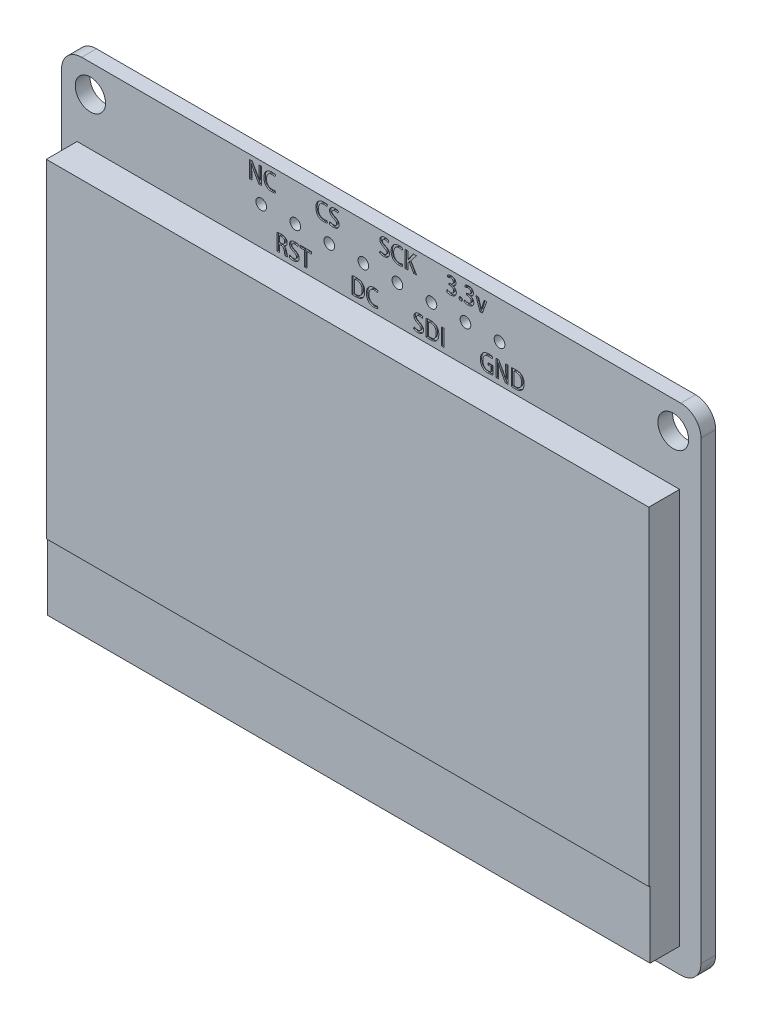
from build123d import *

# Parameters (mm, degrees)
ESQUISSE1_R             = 1.130678028
ESQUISSE1_R_2           = 1.147400099
ESQUISSE1_R_3           = 0.39769701
BOSS_EXTRU_1_DEPTH      = 1.1
ACTIVE_W                = 44.952079982
ACTIVE_H                = 29.518313136
BOSS_EXTRU_2_DEPTH      = 3.4
ESQUISSE3_W             = 44.952079982
ESQUISSE3_H             = 5.003162559
ENL_V_MAT_EXTRU_1_DEPTH = 0.1
ESQUISSE4_W             = 0.446033444
ESQUISSE4_H             = 0.118264801
ENL_V_MAT_EXTRU_2_DEPTH = 0.1
ENL_V_MAT_EXTRU_3_DEPTH = 0.1
ESQUISSE6_W             = 0.190537595
ESQUISSE6_H             = 1.241777777
ENL_V_MAT_EXTRU_4_DEPTH = 0.1


with BuildPart() as part:
    # Esquisse1 → Boss.-Extru.1 (new body)
    with BuildSketch(Plane.XY):
        with BuildLine():
            Line((6.063582832, 251.635662082), (50.769922727, 251.635662082))
            ThreePointArc((50.769922727, 251.635662082), (51.830582899, 251.196322254), (52.269922727, 250.135662082))
            Line((52.269922727, 250.135662082), (52.269922727, 216.171547671))
            ThreePointArc((52.269922727, 216.171547671), (51.830582899, 215.1108875), (50.769922727, 214.671547671))
            Line((50.769922727, 214.671547671), (6.063582832, 214.671547671))
            ThreePointArc((6.063582832, 214.671547671), (5.00292266, 215.1108875), (4.563582832, 216.171547671))
            Line((4.563582832, 216.171547671), (4.563582832, 250.135662082))
            ThreePointArc((4.563582832, 250.135662082), (5.00292266, 251.196322254), (6.063582832, 251.635662082))
        make_face()
        with Locations((6.715143335, 249.555873868)):
            Circle(ESQUISSE1_R, mode=Mode.SUBTRACT)
        with Locations((50.202777817, 249.560880462)):
            Circle(ESQUISSE1_R_2, mode=Mode.SUBTRACT)
        with Locations((19.461608775, 248.836889944)):
            Circle(ESQUISSE1_R_3, mode=Mode.SUBTRACT)
        with Locations((22.001608775, 248.836889944)):
            Circle(ESQUISSE1_R_3, mode=Mode.SUBTRACT)
        with Locations((24.541608775, 248.836889944)):
            Circle(ESQUISSE1_R_3, mode=Mode.SUBTRACT)
        with Locations((27.081608775, 248.836889944)):
            Circle(ESQUISSE1_R_3, mode=Mode.SUBTRACT)
        with Locations((29.621608775, 248.836889944)):
            Circle(ESQUISSE1_R_3, mode=Mode.SUBTRACT)
        with Locations((32.161608775, 248.836889944)):
            Circle(ESQUISSE1_R_3, mode=Mode.SUBTRACT)
        with Locations((34.701608775, 248.836889944)):
            Circle(ESQUISSE1_R_3, mode=Mode.SUBTRACT)
        with Locations((37.241608775, 248.836889944)):
            Circle(ESQUISSE1_R_3, mode=Mode.SUBTRACT)
    extrude(amount=BOSS_EXTRU_1_DEPTH)

    # active → Boss.-Extru.2 (add)
    with BuildSketch(Plane.XY):
        with Locations((28.201406192, 231.263148145)):
            Rectangle(ACTIVE_W, ACTIVE_H)
    extrude(amount=BOSS_EXTRU_2_DEPTH)

    # Esquisse3 → Enlèv. mat.-Extru.1 (cut)
    with BuildSketch(Plane.XY.offset(3.4)):
        with Locations((28.201406192, 219.005572857)):
            Rectangle(ESQUISSE3_W, ESQUISSE3_H)
    extrude(amount=-ENL_V_MAT_EXTRU_1_DEPTH, mode=Mode.SUBTRACT)

    # Esquisse4 → Enlèv. mat.-Extru.2 (cut)
    # profile 1 of 10: a face of its own
    with BuildSketch(Plane.XY.offset(1.1)):
        with BuildLine():
            add(Edge.make_bspline(
                [(6.446904232, 216.407395359), (6.426970687, 216.406570554), (6.388046517, 216.40495996), (6.331342832, 216.396069216), (6.277769977, 216.382405829), (6.227494553, 216.363014614), (6.180356897, 216.338466354), (6.136530993, 216.308477287), (6.095945785, 216.273255607), (6.058841531, 216.233012925), (6.025591555, 216.188124879), (5.996267359, 216.139066306), (5.971795449, 216.085777453), (5.951237729, 216.028742129), (5.935438354, 215.967674204), (5.923736149, 215.902739986), (5.916443404, 215.833792484), (5.915079713, 215.786485205), (5.914380241, 215.76222011)],
                knots=[0, 0, 0, 0, 1.01693825, 1.985772131, 2.921518734, 3.832117633, 4.727948323, 5.626511184, 6.534414133, 7.463288783, 8.412839634, 9.378967074, 10.373196777, 11.399194858, 12.46754142, 13.586614818, 14.762113956, 16, 16, 16, 16], degree=3))
            add(Edge.make_bspline(
                [(5.914380241, 215.76222011), (5.914883326, 215.738889304), (5.915866523, 215.693293082), (5.923304219, 215.626869626), (5.93361986, 215.563995946), (5.949197133, 215.505011136), (5.968064338, 215.44943583), (5.992067282, 215.397933551), (6.01949598, 215.349775226), (6.051417524, 215.305847018), (6.086754701, 215.265916597), (6.125960739, 215.231238421), (6.168474052, 215.201677385), (6.214388257, 215.17731089), (6.263728003, 215.158289639), (6.316381483, 215.14451911), (6.372287598, 215.135656138), (6.410713939, 215.134132639), (6.430379832, 215.133352941)],
                knots=[0, 0, 0, 0, 1.222557966, 2.38928844, 3.500048728, 4.559063003, 5.583344684, 6.572073494, 7.532658458, 8.483942143, 9.413076429, 10.322121769, 11.220566177, 12.121066096, 13.040014193, 13.985715855, 14.969126498, 16, 16, 16, 16], degree=3))
            add(Edge.make_bspline(
                [(6.430379832, 215.133352941), (6.44941253, 215.133845046), (6.486769636, 215.134810943), (6.541391761, 215.142508572), (6.593347621, 215.154816532), (6.642492136, 215.172485654), (6.688757368, 215.195479489), (6.732400168, 215.223254111), (6.773232693, 215.256222384), (6.811390664, 215.293927383), (6.845669511, 215.33710923), (6.876025968, 215.385285359), (6.901181471, 215.439021353), (6.922295121, 215.497617848), (6.938918502, 215.561399475), (6.950883804, 215.630231702), (6.958747928, 215.704243422), (6.960185384, 215.755316511), (6.960927843, 215.78169622)],
                knots=[0, 0, 0, 0, 0.964759122, 1.89361537, 2.791129421, 3.668077106, 4.535429534, 5.405715028, 6.285894481, 7.191747456, 8.120239528, 9.075412678, 10.072429751, 11.12252868, 12.229792465, 13.410030886, 14.662257747, 16, 16, 16, 16], degree=3))
            add(Edge.make_bspline(
                [(6.960927843, 215.78169622), (6.960538741, 215.804159464), (6.959777894, 215.848083883), (6.953358311, 215.912323063), (6.942762395, 215.973217681), (6.928578999, 216.031042773), (6.910057602, 216.085646084), (6.88724341, 216.137000059), (6.860311204, 216.185096884), (6.829856015, 216.229969992), (6.795036786, 216.270488647), (6.756459025, 216.306115341), (6.714073695, 216.336584842), (6.667658743, 216.36109899), (6.617798643, 216.381139074), (6.564009595, 216.395158159), (6.50664149, 216.404548773), (6.467101315, 216.406352444), (6.446904232, 216.407395359)],
                knots=[0, 0, 0, 0, 1.181997023, 2.311265979, 3.393394717, 4.432710499, 5.441572568, 6.423779709, 7.385757606, 8.339154063, 9.273212536, 10.190881701, 11.096730823, 12.012033381, 12.946898792, 13.918455472, 14.931549697, 16, 16, 16, 16], degree=3))
        make_face()
        with BuildLine():
            add(Edge.make_bspline(
                [(6.440331228, 216.259798837), (6.45386812, 216.258641379), (6.480330374, 216.25637875), (6.518669268, 216.248162249), (6.554272315, 216.235503484), (6.587174169, 216.218421406), (6.617066298, 216.196786792), (6.644632611, 216.17127676), (6.66909921, 216.141168095), (6.69036272, 216.107100659), (6.70914716, 216.070472169), (6.725487925, 216.032140576), (6.739796087, 215.99266835), (6.750862791, 215.95164048), (6.759961089, 215.90945954), (6.765840988, 215.865831557), (6.769813725, 215.820957356), (6.770196456, 215.790543779), (6.770390477, 215.775125966)],
                knots=[0, 0, 0, 0, 0.999589655, 1.954022852, 2.877517249, 3.773878129, 4.673599429, 5.586311784, 6.531597741, 7.520501744, 8.537853166, 9.559417173, 10.586727125, 11.626167667, 12.685579831, 13.761408337, 14.865171654, 16, 16, 16, 16], degree=3))
            add(Edge.make_bspline(
                [(6.770390477, 215.775125966), (6.77008651, 215.758303341), (6.769490535, 215.725320039), (6.765801055, 215.676796595), (6.759196622, 215.630340842), (6.750160395, 215.585763914), (6.73806805, 215.543345481), (6.723926668, 215.502743802), (6.706586791, 215.464405519), (6.687216163, 215.428157811), (6.665014371, 215.394974324), (6.640171932, 215.36570125), (6.612575073, 215.340673674), (6.582471381, 215.319914451), (6.549670095, 215.30352851), (6.514349962, 215.291669084), (6.476576538, 215.283369212), (6.450369563, 215.281768606), (6.436950086, 215.280949004)],
                knots=[0, 0, 0, 0, 1.215141369, 2.382468418, 3.512223075, 4.602497428, 5.664896563, 6.695933009, 7.704955915, 8.700973005, 9.661508233, 10.583141316, 11.467103885, 12.344670232, 13.216342825, 14.106081872, 15.030205112, 16, 16, 16, 16], degree=3))
            add(Edge.make_bspline(
                [(6.436950086, 215.280949004), (6.42376804, 215.28187562), (6.397961922, 215.283689629), (6.360606915, 215.291873518), (6.32560816, 215.304001642), (6.293235357, 215.320621829), (6.263211334, 215.341231098), (6.236014788, 215.366417173), (6.210817625, 215.39545934), (6.188961022, 215.42880981), (6.16936449, 215.46484056), (6.152281173, 215.50291814), (6.137569356, 215.542693859), (6.126058377, 215.584361309), (6.116490657, 215.627557736), (6.110094726, 215.672509337), (6.105965366, 215.71912325), (6.10542656, 215.750791291), (6.105152259, 215.766913149)],
                knots=[0, 0, 0, 0, 0.968573833, 1.896149455, 2.796477749, 3.679461465, 4.558257033, 5.460120664, 6.392036362, 7.372592241, 8.379386201, 9.399199485, 10.432362265, 11.48798156, 12.568687675, 13.676620176, 14.817192429, 16, 16, 16, 16], degree=3))
            add(Edge.make_bspline(
                [(6.105152259, 215.766913149), (6.105250115, 215.782643814), (6.105443692, 215.813761814), (6.10946516, 215.859651578), (6.115356444, 215.904287572), (6.124387334, 215.947350112), (6.135602963, 215.989080269), (6.149458201, 216.029425429), (6.166191813, 216.068229066), (6.184905669, 216.105512357), (6.206385449, 216.139964685), (6.231240649, 216.17039436), (6.259043973, 216.196339979), (6.289715433, 216.218047586), (6.323333768, 216.235222395), (6.359756871, 216.24817015), (6.3990364, 216.256778919), (6.426269231, 216.258698016), (6.440331228, 216.259798837)],
                knots=[0, 0, 0, 0, 1.136547726, 2.248289582, 3.326834991, 4.389002452, 5.425786828, 6.448433384, 7.469124786, 8.477926495, 9.461316408, 10.397265518, 11.309260955, 12.201738065, 13.104381261, 14.028854752, 14.989125284, 16, 16, 16, 16], degree=3))
        make_face(mode=Mode.SUBTRACT)
    # profile 2 of 10: a face of its own
    with BuildSketch(Plane.XY.offset(1.1)):
        with BuildLine():
            Line((7.161085709, 215.150582442), (7.351623305, 215.150582442))
            Line((7.351623305, 215.150582442), (7.351623305, 215.637076157))
            add(Edge.make_bspline(
                [(7.351623305, 215.637076157), (7.359586367, 215.635663586), (7.375990051, 215.632753728), (7.401562279, 215.630382699), (7.428648602, 215.62889725), (7.44720254, 215.628924035), (7.456747369, 215.628937814)],
                knots=[0, 0, 0, 0, 0.918571729, 1.892231672, 2.915686383, 4, 4, 4, 4], degree=3))
            add(Edge.make_bspline(
                [(7.456747369, 215.628937814), (7.471226318, 215.628945723), (7.49984658, 215.628961355), (7.542183311, 215.632930334), (7.583455481, 215.639408865), (7.623643076, 215.649020673), (7.662727015, 215.661823882), (7.70079187, 215.677283014), (7.737755611, 215.695677364), (7.77339781, 215.716764028), (7.806671108, 215.741438663), (7.836107075, 215.770568259), (7.861044169, 215.803958982), (7.881889636, 215.841295725), (7.898488094, 215.88254833), (7.910883502, 215.927814197), (7.919142888, 215.977041416), (7.921067513, 216.011309754), (7.922062143, 216.029019353)],
                knots=[0, 0, 0, 0, 1.002223409, 1.981075816, 2.941057117, 3.893567037, 4.839120738, 5.786658294, 6.736252809, 7.695867274, 8.651375827, 9.597441389, 10.552949943, 11.527852714, 12.550822771, 13.624507394, 14.772364707, 16, 16, 16, 16], degree=3))
            add(Edge.make_bspline(
                [(7.922062143, 216.029019353), (7.921452105, 216.042884707), (7.9202612, 216.069952364), (7.914325433, 216.109242406), (7.905191247, 216.146111854), (7.892797319, 216.18065575), (7.876739972, 216.212624622), (7.857587686, 216.242300291), (7.83506721, 216.269534711), (7.81753651, 216.285308987), (7.808725262, 216.293237425)],
                knots=[0, 0, 0, 0, 1.121960372, 2.190267843, 3.207584746, 4.190239261, 5.152208329, 6.094546313, 7.042284316, 8, 8, 8, 8], degree=3))
            add(Edge.make_bspline(
                [(7.808725262, 216.293237425), (7.798815835, 216.301233564), (7.778685213, 216.317477416), (7.744410906, 216.337576529), (7.706771911, 216.354626437), (7.665633536, 216.368797351), (7.620835388, 216.379525403), (7.572458671, 216.386712849), (7.520597025, 216.391670185), (7.484840044, 216.392059447), (7.466368098, 216.392260539)],
                knots=[0, 0, 0, 0, 0.838628006, 1.70364077, 2.610636308, 3.559859354, 4.568055018, 5.643200099, 6.782484425, 8, 8, 8, 8], degree=3))
            add(Edge.make_bspline(
                [(7.466368098, 216.392260539), (7.450802136, 216.391981031), (7.420447961, 216.391435981), (7.376167432, 216.390085306), (7.334310051, 216.388007579), (7.294892528, 216.38512485), (7.257869045, 216.381962565), (7.223283606, 216.377966482), (7.19120162, 216.373331246), (7.170697457, 216.369632763), (7.160851287, 216.367856738)],
                knots=[0, 0, 0, 0, 1.217605855, 2.374374404, 3.464660226, 4.494999595, 5.465333604, 6.370582827, 7.217548217, 8, 8, 8, 8], degree=3))
            Line((7.160851287, 216.367856738), (7.161085709, 215.150582442))
        make_face()
        with BuildLine():
            add(Edge.make_bspline(
                [(7.351623305, 216.233579005), (7.358960347, 216.235024492), (7.375572609, 216.238297312), (7.403971969, 216.24130319), (7.438646349, 216.243602164), (7.463938711, 216.244291361), (7.47763139, 216.244664475)],
                knots=[0, 0, 0, 0, 0.7081459, 1.603358068, 2.702515415, 4, 4, 4, 4], degree=3))
            add(Edge.make_bspline(
                [(7.47763139, 216.244664475), (7.48694461, 216.244469972), (7.505138261, 216.244090005), (7.531742154, 216.241544215), (7.556910651, 216.237064023), (7.580684093, 216.230966078), (7.603076716, 216.223340406), (7.623934356, 216.213555549), (7.643383733, 216.202136868), (7.661291164, 216.188906851), (7.677662782, 216.174184676), (7.691752571, 216.1573767), (7.703884188, 216.138904316), (7.713701314, 216.118601494), (7.721464171, 216.096639831), (7.727067901, 216.072965013), (7.73061689, 216.047583069), (7.731216691, 216.030048031), (7.731524777, 216.021041187)],
                knots=[0, 0, 0, 0, 1.16517395, 2.276202082, 3.339667925, 4.360262278, 5.344409501, 6.294443781, 7.237649562, 8.161467064, 9.075802852, 9.985465996, 10.897442204, 11.83402534, 12.799705885, 13.806079676, 14.873096483, 16, 16, 16, 16], degree=3))
            add(Edge.make_bspline(
                [(7.731524777, 216.021041187), (7.731209888, 216.011488788), (7.730596025, 215.992866768), (7.727125985, 215.965816315), (7.721214882, 215.940528698), (7.713228553, 215.916937163), (7.703206454, 215.894946985), (7.690614166, 215.874797509), (7.675715926, 215.856447202), (7.658777617, 215.839687665), (7.639758593, 215.82493115), (7.61881385, 215.812220601), (7.596277358, 215.801088845), (7.571785097, 215.792215382), (7.545496712, 215.785530088), (7.51753955, 215.780265475), (7.48770638, 215.77729314), (7.467234657, 215.776791076), (7.456747369, 215.776533878)],
                knots=[0, 0, 0, 0, 1.098810706, 2.142087657, 3.130558938, 4.080710143, 5.002414742, 5.90351999, 6.805477983, 7.715119197, 8.638227497, 9.567016518, 10.528554789, 11.524610674, 12.556657526, 13.645294696, 14.7937276, 16, 16, 16, 16], degree=3))
            add(Edge.make_bspline(
                [(7.456747369, 215.776533878), (7.446497615, 215.77649858), (7.426921194, 215.776431165), (7.399117999, 215.778102794), (7.374183585, 215.780849732), (7.35887223, 215.784450078), (7.351623305, 215.786154607)],
                knots=[0, 0, 0, 0, 1.161542367, 2.218477041, 3.156565424, 4, 4, 4, 4], degree=3))
            Line((7.351623305, 215.786154607), (7.351623305, 216.233579005))
        make_face(mode=Mode.SUBTRACT)
    # profile 3 of 10: a face of its own
    with BuildSketch(Plane.XY.offset(1.1)):
        Polygon((8.78594376, 215.296084283), (8.297739881, 215.296084283), (8.297739881, 215.719161023), (8.732419747, 215.719161023), (8.732419747, 215.866757544), (8.297739881, 215.866757544), (8.297739881, 216.229763391), (8.758370784, 216.229763391), (8.758370784, 216.377359912), (8.107202286, 216.377359912), (8.107202286, 215.148487761), (8.78594376, 215.148487761), align=None)
    # profile 4 of 10: a face of its own
    with BuildSketch(Plane.XY.offset(1.1)):
        with BuildLine():
            Line((9.874600613, 216.391321702), (9.699080741, 216.391321702))
            Line((9.699080741, 216.391321702), (9.699080741, 215.933604929))
            add(Edge.make_bspline(
                [(9.699080741, 215.933604929), (9.699002974, 215.909327499), (9.698850282, 215.861660589), (9.699953777, 215.791390892), (9.70132568, 215.723574538), (9.703741316, 215.636489179), (9.708759788, 215.529576372), (9.715295908, 215.444643818), (9.71855731, 215.402264051)],
                knots=[0, 0, 0, 0, 0.821614023, 1.613177398, 2.378363483, 3.117216942, 4.56154481, 6, 6, 6, 6], degree=3))
            Line((9.71855731, 215.402264051), (9.713853959, 215.400745688))
            add(Edge.make_bspline(
                [(9.713853959, 215.400745688), (9.699644879, 215.434764669), (9.670653109, 215.504175951), (9.621590119, 215.607734472), (9.568998432, 215.712721603), (9.530471861, 215.781757172), (9.511125005, 215.816424706)],
                knots=[0, 0, 0, 0, 0.955842181, 1.950270942, 2.970689279, 4, 4, 4, 4], degree=3))
            Line((9.511125005, 215.816424706), (9.184777106, 216.392729613))
            Line((9.184777106, 216.392729613), (8.978230246, 216.392729613))
            Line((8.978230246, 216.392729613), (8.978230246, 215.148136012))
            Line((8.978230246, 215.148136012), (9.153750117, 215.148136012))
            Line((9.153750117, 215.148136012), (9.153750117, 215.611132912))
            add(Edge.make_bspline(
                [(9.153750117, 215.611132912), (9.153685478, 215.637639071), (9.153559416, 215.689331619), (9.153148753, 215.764881767), (9.15223292, 215.836375199), (9.150319656, 215.925158431), (9.147349463, 216.030405288), (9.142816833, 216.113110493), (9.140609609, 216.153384875)],
                knots=[0, 0, 0, 0, 0.879484195, 1.715177864, 2.506803862, 3.251809647, 4.661732754, 6, 6, 6, 6], degree=3))
            Line((9.140609609, 216.153384875), (9.147189029, 216.155125745))
            add(Edge.make_bspline(
                [(9.147189029, 216.155125745), (9.162238833, 216.11930272), (9.192671803, 216.046863163), (9.24371902, 215.93986818), (9.297854438, 215.833813724), (9.33562296, 215.764024021), (9.354377516, 215.72936884)],
                knots=[0, 0, 0, 0, 0.984107413, 1.990013513, 3.00190943, 4, 4, 4, 4], degree=3))
            Line((9.354377516, 215.72936884), (9.682753642, 215.148136012))
            Line((9.682753642, 215.148136012), (9.874600613, 215.148136012))
            Line((9.874600613, 215.148136012), (9.874600613, 216.391321702))
        make_face()
    # profile 5 of 10: a face of its own
    with BuildSketch(Plane.XY.offset(1.1)):
        with Locations((10.282425895, 215.642782164)):
            Rectangle(ESQUISSE4_W, ESQUISSE4_H)
    # profile 6 of 10: a face of its own
    with BuildSketch(Plane.XY.offset(1.1)):
        with BuildLine():
            add(Edge.make_bspline(
                [(11.314744745, 216.354136246), (11.307478214, 216.357464801), (11.292152962, 216.364484787), (11.267043027, 216.373840432), (11.238759991, 216.382653257), (11.207318072, 216.390874511), (11.172821304, 216.398002616), (11.135263599, 216.403003891), (11.094692533, 216.406349997), (11.066639685, 216.406961157), (11.052084221, 216.407278262)],
                knots=[0, 0, 0, 0, 0.710066038, 1.497542928, 2.37906562, 3.341693834, 4.384493934, 5.507055216, 6.706513948, 8, 8, 8, 8], degree=3))
            add(Edge.make_bspline(
                [(11.052084221, 216.407278262), (11.036742175, 216.406768158), (11.006850072, 216.405774282), (10.963314947, 216.401091065), (10.922282519, 216.393607185), (10.883770735, 216.383403509), (10.847804065, 216.370173152), (10.814314178, 216.354183154), (10.783293611, 216.335460908), (10.755034424, 216.314006029), (10.729670899, 216.290372447), (10.707529629, 216.264688864), (10.688543884, 216.23728729), (10.672935622, 216.207927113), (10.660681952, 216.176671811), (10.652184486, 216.143550177), (10.646208904, 216.108776654), (10.645384965, 216.084892722), (10.644963125, 216.072664612)],
                knots=[0, 0, 0, 0, 1.24605972, 2.427795281, 3.551358678, 4.629716266, 5.658460298, 6.658336329, 7.638577082, 8.5950144, 9.534089131, 10.448178897, 11.343072278, 12.235166994, 13.142080717, 14.061713137, 15.00763471, 16, 16, 16, 16], degree=3))
            add(Edge.make_bspline(
                [(10.644963125, 216.072664612), (10.645427591, 216.06232857), (10.64634257, 216.041967013), (10.650471431, 216.012057247), (10.657697156, 215.983537917), (10.667007538, 215.95601843), (10.679298429, 215.929849606), (10.693840701, 215.90476796), (10.711229525, 215.881164497), (10.730925319, 215.858706098), (10.752887602, 215.837390985), (10.776556536, 215.816920337), (10.802276996, 215.797683568), (10.829742357, 215.779436275), (10.858923463, 215.761995775), (10.889966549, 215.745616672), (10.922723754, 215.730066237), (10.945502187, 215.720883641), (10.95705019, 215.716228332)],
                knots=[0, 0, 0, 0, 0.982430359, 1.935345551, 2.861473909, 3.773036523, 4.690393026, 5.602681888, 6.522471742, 7.470130913, 8.436760716, 9.427080411, 10.440400235, 11.485043444, 12.557810827, 13.667797358, 14.817641176, 16, 16, 16, 16], degree=3))
            add(Edge.make_bspline(
                [(10.95705019, 215.716228332), (10.966079236, 215.712472691), (10.983573695, 215.705195852), (11.008552087, 215.693307091), (11.031731911, 215.681501035), (11.053041307, 215.6692111), (11.072452706, 215.656582539), (11.090104015, 215.643776738), (11.105742551, 215.630474263), (11.119685186, 215.616945707), (11.131731313, 215.60263648), (11.142446329, 215.58796291), (11.151049411, 215.572243695), (11.158519179, 215.556109296), (11.163795751, 215.538945499), (11.167898219, 215.521247308), (11.169938789, 215.502664959), (11.170210133, 215.490106056), (11.170348793, 215.483688271)],
                knots=[0, 0, 0, 0, 1.388607844, 2.690532481, 3.927623255, 5.08226696, 6.182233573, 7.215384472, 8.176896206, 9.095953171, 9.970708446, 10.830739382, 11.671250476, 12.511541319, 13.351171065, 14.216280617, 15.088492993, 16, 16, 16, 16], degree=3))
            add(Edge.make_bspline(
                [(11.170348793, 215.483688271), (11.170070756, 215.476720052), (11.169528055, 215.463118777), (11.166831208, 215.443243048), (11.161726383, 215.424598921), (11.155213604, 215.406845986), (11.146743887, 215.390130024), (11.136354562, 215.374525842), (11.123978962, 215.360124947), (11.109949125, 215.346789511), (11.094156237, 215.334655985), (11.076432857, 215.324505186), (11.057294115, 215.315388778), (11.036402787, 215.308244935), (11.013934127, 215.302652083), (10.989876, 215.298379121), (10.964139472, 215.295887956), (10.94641766, 215.29531938), (10.937339428, 215.29502812)],
                knots=[0, 0, 0, 0, 0.989950937, 1.932286624, 2.840091741, 3.729158814, 4.613217802, 5.494132279, 6.384308434, 7.30338771, 8.238497294, 9.204167894, 10.197787286, 11.244421132, 12.332593329, 13.482860627, 14.710562059, 16, 16, 16, 16], degree=3))
            add(Edge.make_bspline(
                [(10.937339428, 215.29502812), (10.924423604, 215.29540788), (10.898846397, 215.296159919), (10.860971335, 215.300214775), (10.824012463, 215.30670572), (10.788393027, 215.316029113), (10.754279797, 215.326527234), (10.722642845, 215.339104275), (10.693253079, 215.352542375), (10.675156536, 215.363088019), (10.66631645, 215.368239522)],
                knots=[0, 0, 0, 0, 1.091755245, 2.162003133, 3.216267832, 4.260055132, 5.271996961, 6.23076115, 7.135734233, 8, 8, 8, 8], degree=3))
            Line((10.66631645, 215.368239522), (10.62411233, 215.209862761))
            add(Edge.make_bspline(
                [(10.62411233, 215.209862761), (10.632600419, 215.204581555), (10.650458603, 215.193470369), (10.680929804, 215.179931113), (10.71547108, 215.167229648), (10.753937737, 215.156277568), (10.794981463, 215.14701339), (10.837571986, 215.13985578), (10.881329247, 215.135615852), (10.910893029, 215.134892136), (10.925841483, 215.134526201)],
                knots=[0, 0, 0, 0, 0.761703857, 1.602557085, 2.536844329, 3.567754473, 4.650347393, 5.744907002, 6.85974825, 8, 8, 8, 8], degree=3))
            add(Edge.make_bspline(
                [(10.925841483, 215.134526201), (10.942985965, 215.135071632), (10.976340535, 215.136132768), (11.024801846, 215.141607954), (11.070172966, 215.149917295), (11.112359959, 215.16137513), (11.151470665, 215.175939812), (11.187362177, 215.193788352), (11.220296648, 215.214446766), (11.249720248, 215.238277316), (11.275738005, 215.264634447), (11.298607516, 215.292808696), (11.318042568, 215.322820753), (11.333867898, 215.354703097), (11.346059248, 215.388512406), (11.354970991, 215.424030522), (11.360519162, 215.461379651), (11.361228395, 215.486875812), (11.361590115, 215.499879254)],
                knots=[0, 0, 0, 0, 1.285635255, 2.501201915, 3.652546696, 4.740889107, 5.774566479, 6.77641306, 7.741186608, 8.683618437, 9.608349835, 10.513231835, 11.399760906, 12.283589774, 13.175918775, 14.08904847, 15.025384736, 16, 16, 16, 16], degree=3))
            add(Edge.make_bspline(
                [(11.361590115, 215.499879254), (11.361479896, 215.510294114), (11.361263746, 215.530718591), (11.357492406, 215.560671543), (11.351936073, 215.58948941), (11.344084209, 215.617120831), (11.333494996, 215.643382903), (11.321183185, 215.668683439), (11.306059166, 215.69253451), (11.288780719, 215.715298455), (11.269040544, 215.736914815), (11.247298652, 215.758157213), (11.222718258, 215.778240697), (11.195914147, 215.797726563), (11.166819848, 215.816537693), (11.135120579, 215.834301518), (11.101255851, 215.851767222), (11.077409006, 215.862231977), (11.065224729, 215.867578826)],
                knots=[0, 0, 0, 0, 0.989439626, 1.940380097, 2.864963469, 3.778113219, 4.66599554, 5.553908999, 6.449325998, 7.346131361, 8.267509617, 9.229865655, 10.233372073, 11.281958258, 12.379270913, 13.524806285, 14.735327667, 16, 16, 16, 16], degree=3))
            add(Edge.make_bspline(
                [(11.065224729, 215.867578826), (11.055648458, 215.871570151), (11.036994285, 215.879345084), (11.010374562, 215.891933526), (10.985389582, 215.903935862), (10.962652551, 215.916399093), (10.941893235, 215.928944238), (10.922914127, 215.941225233), (10.905958041, 215.953649158), (10.890964967, 215.966241638), (10.877576655, 215.979102451), (10.866355334, 215.993097959), (10.856553245, 216.00767191), (10.848760107, 216.023288387), (10.842949345, 216.03979862), (10.838710175, 216.057083856), (10.836014324, 216.075160415), (10.835829093, 216.087516311), (10.835735143, 216.093783285)],
                knots=[0, 0, 0, 0, 1.445224602, 2.81523659, 4.101880901, 5.306437408, 6.425914179, 7.480779251, 8.455055295, 9.352231816, 10.20759927, 11.036454723, 11.846470091, 12.650599711, 13.460615078, 14.279959705, 15.12758675, 16, 16, 16, 16], degree=3))
            add(Edge.make_bspline(
                [(10.835735143, 216.093783285), (10.836222656, 216.10401885), (10.837195576, 216.124445745), (10.846850843, 216.154222729), (10.863074743, 216.182025603), (10.881235808, 216.203373755), (10.899017418, 216.21883227), (10.914661628, 216.229172361), (10.93215108, 216.23808512), (10.951468163, 216.245612458), (10.972702607, 216.251465511), (10.99590113, 216.255495894), (11.020871843, 216.25870959), (11.038228889, 216.259351851), (11.04715653, 216.259682199)],
                knots=[0, 0, 0, 0, 1.221869825, 2.438459087, 3.700322146, 5.054532194, 5.771230136, 6.513622565, 7.29218281, 8.116005944, 8.990228273, 9.922773838, 10.931573349, 12, 12, 12, 12], degree=3))
            add(Edge.make_bspline(
                [(11.04715653, 216.259682199), (11.059680377, 216.259294745), (11.084000649, 216.25854234), (11.119062465, 216.254831295), (11.151515343, 216.248938457), (11.181119541, 216.2412572), (11.207726782, 216.232294623), (11.231192488, 216.223158499), (11.251515271, 216.214189585), (11.263548677, 216.207439317), (11.269137255, 216.204304344)],
                knots=[0, 0, 0, 0, 1.300339277, 2.525151254, 3.655871472, 4.72127177, 5.696946503, 6.568444816, 7.335154317, 8, 8, 8, 8], degree=3))
            Line((11.269137255, 216.204304344), (11.314744745, 216.354136246))
        make_face()
    # profile 7 of 10: a face of its own
    with BuildSketch(Plane.XY.offset(1.1)):
        with BuildLine():
            Line((12.670100701, 216.391537105), (12.435916243, 216.391537105))
            Line((12.435916243, 216.391537105), (12.256644003, 215.845798361))
            add(Edge.make_bspline(
                [(12.256644003, 215.845798361), (12.244981944, 215.808045554), (12.222154475, 215.734147713), (12.190866736, 215.624875503), (12.163146335, 215.519536072), (12.146611258, 215.450398462), (12.138522651, 215.416577819)],
                knots=[0, 0, 0, 0, 1.06482216, 2.08429696, 3.06287894, 4, 4, 4, 4], degree=3))
            Line((12.138522651, 215.416577819), (12.133899046, 215.416577819))
            add(Edge.make_bspline(
                [(12.133899046, 215.416577819), (12.125954899, 215.450713619), (12.109793142, 215.520160284), (12.082577044, 215.625463562), (12.053172223, 215.733953672), (12.031658472, 215.806999308), (12.020727383, 215.844113633)],
                knots=[0, 0, 0, 0, 0.950771496, 1.934271678, 2.950408035, 4, 4, 4, 4], degree=3))
            Line((12.020727383, 215.844113633), (11.846417435, 216.391537105))
            Line((11.846417435, 216.391537105), (11.613848042, 216.391537105))
            Line((11.613848042, 216.391537105), (11.529835319, 215.151800157))
            Line((11.529835319, 215.151800157), (11.704291695, 215.151800157))
            Line((11.704291695, 215.151800157), (11.731747804, 215.660453127))
            add(Edge.make_bspline(
                [(11.731747804, 215.660453127), (11.734225886, 215.705008563), (11.739225996, 215.794909592), (11.744092119, 215.907315433), (11.748446035, 215.996856498), (11.750555998, 216.06187087), (11.752907775, 216.12451154), (11.753749322, 216.165428722), (11.754162792, 216.185532189)],
                knots=[0, 0, 0, 0, 1.528265809, 3.083634274, 3.853229214, 4.59840858, 5.311368824, 6, 6, 6, 6], degree=3))
            Line((11.754162792, 216.185532189), (11.759203913, 216.185550751))
            add(Edge.make_bspline(
                [(11.759203913, 216.185550751), (11.767468599, 216.147166348), (11.784235216, 216.069295689), (11.813915122, 215.951879621), (11.846533393, 215.831851224), (11.871041771, 215.751521014), (11.883456004, 215.710831338)],
                knots=[0, 0, 0, 0, 0.959753872, 1.947058171, 2.960122984, 4, 4, 4, 4], degree=3))
            Line((11.883456004, 215.710831338), (12.053145784, 215.163153736))
            Line((12.053145784, 215.163153736), (12.193656459, 215.163153736))
            Line((12.193656459, 215.163153736), (12.377773895, 215.722234871))
            add(Edge.make_bspline(
                [(12.377773895, 215.722234871), (12.390694176, 215.761800057), (12.4162804, 215.840151581), (12.451781651, 215.957095303), (12.484786487, 216.071915522), (12.50494265, 216.147952671), (12.514904345, 216.185532189)],
                knots=[0, 0, 0, 0, 1.033513873, 2.046682856, 3.034620343, 4, 4, 4, 4], degree=3))
            Line((12.514904345, 216.185532189), (12.519899635, 216.185550751))
            add(Edge.make_bspline(
                [(12.519899635, 216.185550751), (12.519822102, 216.165598938), (12.519664015, 216.124918004), (12.520469039, 216.062882397), (12.521773646, 215.998735276), (12.525103942, 215.91097748), (12.52976457, 215.801158413), (12.533951656, 215.713410854), (12.536023018, 215.670001902)],
                knots=[0, 0, 0, 0, 0.69615936, 1.419440619, 2.164688967, 2.934803833, 4.483639269, 6, 6, 6, 6], degree=3))
            Line((12.536023018, 215.670001902), (12.563506396, 215.151800157))
            Line((12.563506396, 215.151800157), (12.744393702, 215.151800157))
            Line((12.744393702, 215.151800157), (12.670100701, 216.391537105))
        make_face()
    # profile 8 of 10: a face of its own
    with BuildSketch(Plane.XY.offset(1.1)):
        Polygon((13.491242669, 216.392167503), (13.260959758, 216.392167503), (12.881430428, 215.14397644), (13.074463034, 215.14397644), (13.181495936, 215.508912895), (13.560976227, 215.508912895), (13.672874261, 215.14397644), (13.87072296, 215.14397644), align=None)
        with BuildLine():
            Line((13.210686728, 215.656509416), (13.309611077, 215.984914415))
            add(Edge.make_bspline(
                [(13.309611077, 215.984914415), (13.314901896, 216.004829528), (13.325702566, 216.045484206), (13.339953046, 216.107355454), (13.354049231, 216.169099454), (13.363330609, 216.209935165), (13.367864106, 216.229881404)],
                knots=[0, 0, 0, 0, 0.981880665, 2.004409445, 3.025252049, 4, 4, 4, 4], degree=3))
            Line((13.367864106, 216.229881404), (13.371236081, 216.229973523))
            add(Edge.make_bspline(
                [(13.371236081, 216.229973523), (13.375783441, 216.210144797), (13.385097264, 216.169531938), (13.399981531, 216.108012465), (13.415743408, 216.045559513), (13.427014464, 216.003973989), (13.432628038, 215.983262227)],
                knots=[0, 0, 0, 0, 0.960134074, 1.966530216, 2.987225846, 4, 4, 4, 4], degree=3))
            Line((13.432628038, 215.983262227), (13.530163725, 215.656509416))
            Line((13.530163725, 215.656509416), (13.210686728, 215.656509416))
        make_face(mode=Mode.SUBTRACT)
    # profile 9 of 10: a face of its own
    with BuildSketch(Plane.XY.offset(1.1)):
        with BuildLine():
            add(Edge.make_bspline(
                [(14.560744913, 215.738095188), (14.568646809, 215.741009976), (14.584333124, 215.746796217), (14.606821254, 215.757548924), (14.628593755, 215.769204155), (14.649169192, 215.782529004), (14.668522, 215.797481581), (14.686864836, 215.813710018), (14.704252855, 215.831295478), (14.720462004, 215.850311769), (14.73526324, 215.87063505), (14.748164257, 215.892331709), (14.7594417, 215.915229887), (14.768040491, 215.93967323), (14.775618193, 215.965129726), (14.780483531, 215.991974755), (14.784288581, 216.019998775), (14.784866608, 216.039173765), (14.785161755, 216.048964767)],
                knots=[0, 0, 0, 0, 0.984448908, 1.954261881, 2.912051287, 3.871106542, 4.816984922, 5.769562366, 6.733317195, 7.706618018, 8.689159246, 9.669611908, 10.655553532, 11.668369991, 12.696152468, 13.758167005, 14.855290571, 16, 16, 16, 16], degree=3))
            add(Edge.make_bspline(
                [(14.785161755, 216.048964767), (14.784872463, 216.061498987), (14.784305998, 216.086042334), (14.779114096, 216.121743143), (14.771605515, 216.155554727), (14.760469767, 216.187164533), (14.746283925, 216.216736196), (14.72911442, 216.244383782), (14.708641954, 216.269870572), (14.69288253, 216.284955281), (14.684965382, 216.292533469)],
                knots=[0, 0, 0, 0, 1.106785191, 2.167204112, 3.181420928, 4.162778401, 5.120989717, 6.07402843, 7.032439092, 8, 8, 8, 8], degree=3))
            add(Edge.make_bspline(
                [(14.684965382, 216.292533469), (14.674925989, 216.300801811), (14.654557645, 216.317576973), (14.619386763, 216.337815211), (14.580751737, 216.355271147), (14.538112251, 216.369294958), (14.491554429, 216.379671309), (14.441215537, 216.387133534), (14.386875335, 216.391369591), (14.349342378, 216.391492853), (14.329937014, 216.391556583)],
                knots=[0, 0, 0, 0, 0.827221313, 1.678301493, 2.574754406, 3.524835391, 4.531659668, 5.609758117, 6.764192347, 8, 8, 8, 8], degree=3))
            add(Edge.make_bspline(
                [(14.329937014, 216.391556583), (14.302084802, 216.391078777), (14.247189707, 216.390137049), (14.179420073, 216.385714406), (14.127490351, 216.380168897), (14.090996026, 216.376113013), (14.056736556, 216.371162976), (14.034658861, 216.367356438), (14.023950899, 216.365510219)],
                knots=[0, 0, 0, 0, 1.630788357, 3.214189375, 3.973790731, 4.688368382, 5.363841967, 6, 6, 6, 6], degree=3))
            Line((14.023950899, 216.365510219), (14.024185321, 215.14824761))
            Line((14.024185321, 215.14824761), (14.214722917, 215.14824761))
            Line((14.214722917, 215.14824761), (14.214722917, 215.673756104))
            Line((14.214722917, 215.673756104), (14.328447066, 215.673756104))
            add(Edge.make_bspline(
                [(14.328447066, 215.673756104), (14.33630377, 215.673656079), (14.351558271, 215.673461873), (14.373763143, 215.670949972), (14.394705517, 215.66739307), (14.414264165, 215.661813953), (14.432267111, 215.654123339), (14.448985356, 215.645107495), (14.464141101, 215.634074324), (14.47823228, 215.621568401), (14.490918912, 215.606789955), (14.502673438, 215.590035031), (14.513461541, 215.571162396), (14.523295552, 215.550086624), (14.532418383, 215.526900844), (14.540587454, 215.501496116), (14.547827495, 215.47397654), (14.55191842, 215.454844232), (14.554029606, 215.444970702)],
                knots=[0, 0, 0, 0, 1.05460192, 2.04760499, 2.997500883, 3.905099692, 4.771330184, 5.622266628, 6.450198754, 7.283312565, 8.146991563, 9.059198733, 10.028584943, 11.062366604, 12.180106072, 13.372689096, 14.644134814, 16, 16, 16, 16], degree=3))
            add(Edge.make_bspline(
                [(14.554029606, 215.444970702), (14.557800024, 215.426576224), (14.565030481, 215.391301495), (14.576393126, 215.340886847), (14.587003288, 215.295138439), (14.597593136, 215.254505741), (14.607262212, 215.219344885), (14.61618675, 215.190062172), (14.624053377, 215.166841889), (14.629902996, 215.153737385), (14.63240335, 215.148136012)],
                knots=[0, 0, 0, 0, 1.465707569, 2.810758609, 4.034056387, 5.131408685, 6.088374617, 6.88023951, 7.521370969, 8, 8, 8, 8], degree=3))
            Line((14.63240335, 215.148136012), (14.829188553, 215.14824761))
            add(Edge.make_bspline(
                [(14.829188553, 215.14824761), (14.825899414, 215.155360901), (14.818423246, 215.171529313), (14.808760899, 215.199892716), (14.79793035, 215.234520253), (14.786992172, 215.275401598), (14.775035243, 215.321533899), (14.762816332, 215.372469602), (14.749261866, 215.427532306), (14.740449121, 215.465764423), (14.73588485, 215.485565486)],
                knots=[0, 0, 0, 0, 0.536382744, 1.219190635, 2.049369578, 3.02138797, 4.116602825, 5.313141612, 6.608430422, 8, 8, 8, 8], degree=3))
            add(Edge.make_bspline(
                [(14.73588485, 215.485565486), (14.732184059, 215.501367982), (14.725046136, 215.531847142), (14.71006672, 215.574631766), (14.693072615, 215.613174022), (14.673423234, 215.647343154), (14.650516688, 215.676989156), (14.623964447, 215.701596114), (14.594038875, 215.721708447), (14.571822665, 215.73053941), (14.56059986, 215.735000486)],
                knots=[0, 0, 0, 0, 1.21940983, 2.351944079, 3.402180539, 4.382494675, 5.308257689, 6.20701365, 7.094249724, 8, 8, 8, 8], degree=3))
            Line((14.56059986, 215.735000486), (14.560744913, 215.738095188))
        make_face()
        with BuildLine():
            Line((14.214722917, 215.807038628), (14.214722917, 216.234211465))
            add(Edge.make_bspline(
                [(14.214722917, 216.234211465), (14.217997839, 216.235081478), (14.22504044, 216.236952407), (14.236741481, 216.238981364), (14.250284625, 216.240812203), (14.265770078, 216.242500118), (14.283155289, 216.24356341), (14.302475917, 216.244503405), (14.323674014, 216.245258451), (14.338461977, 216.245330883), (14.346127997, 216.245368431)],
                knots=[0, 0, 0, 0, 0.614934877, 1.322395026, 2.153817003, 3.09630114, 4.149527974, 5.315346739, 6.6082867, 8, 8, 8, 8], degree=3))
            add(Edge.make_bspline(
                [(14.346127997, 216.245368431), (14.354656834, 216.245313214), (14.371345943, 216.245205167), (14.395892542, 216.243332082), (14.419354676, 216.239862043), (14.441793725, 216.234672167), (14.463231086, 216.227873835), (14.483604909, 216.219404983), (14.502988584, 216.209566133), (14.521127979, 216.19803724), (14.53802106, 216.18478367), (14.552521851, 216.168872399), (14.565184159, 216.151053461), (14.575594295, 216.130934207), (14.583316707, 216.108490809), (14.589619746, 216.084128558), (14.593183565, 216.057507507), (14.594133221, 216.039040114), (14.594624389, 216.029488657)],
                knots=[0, 0, 0, 0, 1.091256665, 2.135355867, 3.147538717, 4.123639677, 5.079671503, 6.022139661, 6.944350032, 7.857936834, 8.76932751, 9.683078809, 10.602350983, 11.560424328, 12.570427029, 13.633781589, 14.776176296, 16, 16, 16, 16], degree=3))
            add(Edge.make_bspline(
                [(14.594624389, 216.029488657), (14.594290672, 216.021265934), (14.593636551, 216.005148552), (14.59037897, 215.981632832), (14.584953715, 215.959384), (14.577487857, 215.938417259), (14.567780261, 215.918872997), (14.556190843, 215.900581611), (14.54245991, 215.88361543), (14.526780257, 215.867903384), (14.509151357, 215.853815759), (14.489839371, 215.841604079), (14.468965821, 215.831264681), (14.446657777, 215.822451505), (14.422521504, 215.816035768), (14.396879669, 215.811153786), (14.369683825, 215.807701121), (14.350988447, 215.807262677), (14.341434958, 215.807038628)],
                knots=[0, 0, 0, 0, 1.040171501, 2.038843028, 2.995952568, 3.931353777, 4.846937716, 5.749610306, 6.664018294, 7.601143361, 8.551071914, 9.51139538, 10.484468404, 11.492790098, 12.538916067, 13.636779592, 14.792375232, 16, 16, 16, 16], degree=3))
            Line((14.341434958, 215.807038628), (14.214722917, 215.807038628))
        make_face(mode=Mode.SUBTRACT)
    # profile 10 of 10: a face of its own
    with BuildSketch(Plane.XY.offset(1.1)):
        Polygon((15.736864606, 216.391356533), (14.876465875, 216.391356533), (14.876465875, 216.230784493), (15.210585473, 216.230784493), (15.210585473, 215.150572589), (15.401123068, 215.150572589), (15.401123068, 216.230784493), (15.736864606, 216.230784493), align=None)
    extrude(amount=-ENL_V_MAT_EXTRU_2_DEPTH, mode=Mode.SUBTRACT)

    # Esquisse5 → Enlèv. mat.-Extru.3 (cut)
    with BuildSketch(Plane.XY.offset(1.1)):
        with BuildLine():
            Line((19.477477021, 251.296829065), (19.301957149, 251.296829065))
            Line((19.301957149, 251.296829065), (19.301957149, 250.839112292))
            add(Edge.make_bspline(
                [(19.301957149, 250.839112292), (19.301879382, 250.814834861), (19.30172669, 250.767167951), (19.302830185, 250.696898255), (19.304202088, 250.6290819), (19.306617724, 250.541996541), (19.311636196, 250.435083734), (19.318172316, 250.35015118), (19.321433718, 250.307771414)],
                knots=[0, 0, 0, 0, 0.821614023, 1.613177398, 2.378363483, 3.117216942, 4.56154481, 6, 6, 6, 6], degree=3))
            Line((19.321433718, 250.307771414), (19.316730367, 250.306253051))
            add(Edge.make_bspline(
                [(19.316730367, 250.306253051), (19.302521287, 250.340272032), (19.273529517, 250.409683313), (19.224466527, 250.513241835), (19.17187484, 250.618228966), (19.133348269, 250.687264535), (19.114001413, 250.721932068)],
                knots=[0, 0, 0, 0, 0.955842181, 1.950270942, 2.970689279, 4, 4, 4, 4], degree=3))
            Line((19.114001413, 250.721932068), (18.787653514, 251.298236976))
            Line((18.787653514, 251.298236976), (18.581106653, 251.298236976))
            Line((18.581106653, 251.298236976), (18.581106653, 250.053643375))
            Line((18.581106653, 250.053643375), (18.756626525, 250.053643375))
            Line((18.756626525, 250.053643375), (18.756626525, 250.516640275))
            add(Edge.make_bspline(
                [(18.756626525, 250.516640275), (18.756561886, 250.543146434), (18.756435824, 250.594838981), (18.756025161, 250.67038913), (18.755109328, 250.741882562), (18.753196064, 250.830665794), (18.750225871, 250.935912651), (18.745693241, 251.018617856), (18.743486017, 251.058892238)],
                knots=[0, 0, 0, 0, 0.879484195, 1.715177864, 2.506803862, 3.251809647, 4.661732754, 6, 6, 6, 6], degree=3))
            Line((18.743486017, 251.058892238), (18.750065437, 251.060633108))
            add(Edge.make_bspline(
                [(18.750065437, 251.060633108), (18.765115241, 251.024810082), (18.795548211, 250.952370526), (18.846595428, 250.845375543), (18.900730846, 250.739321087), (18.938499368, 250.669531383), (18.957253924, 250.634876203)],
                knots=[0, 0, 0, 0, 0.984107413, 1.990013513, 3.00190943, 4, 4, 4, 4], degree=3))
            Line((18.957253924, 250.634876203), (19.28563005, 250.053643375))
            Line((19.28563005, 250.053643375), (19.477477021, 250.053643375))
            Line((19.477477021, 250.053643375), (19.477477021, 251.296829065))
        make_face()
        with BuildLine():
            add(Edge.make_bspline(
                [(20.491964616, 250.244538219), (20.484706243, 250.241257998), (20.469734471, 250.23449192), (20.445566006, 250.226166667), (20.419344732, 250.218635075), (20.381107361, 250.210274772), (20.330494504, 250.202503459), (20.289094144, 250.201199336), (20.268019598, 250.200535483)],
                knots=[0, 0, 0, 0, 0.623452072, 1.285988292, 1.999456477, 2.758826813, 4.350104822, 6, 6, 6, 6], degree=3))
            add(Edge.make_bspline(
                [(20.268019598, 250.200535483), (20.252279781, 250.200959757), (20.221548308, 250.201788139), (20.176738031, 250.207699792), (20.134597937, 250.217506782), (20.095100474, 250.23116771), (20.058244227, 250.248593289), (20.024016763, 250.269863092), (19.992292231, 250.294819479), (19.963696256, 250.323930176), (19.937758861, 250.356269572), (19.915380368, 250.392324898), (19.896340527, 250.431641645), (19.880887826, 250.474459118), (19.868752939, 250.520569713), (19.85996612, 250.570008606), (19.854174802, 250.622774453), (19.853346745, 250.659107694), (19.852920336, 250.677817506)],
                knots=[0, 0, 0, 0, 1.05357022, 2.05706105, 3.019831997, 3.945549259, 4.849673394, 5.743319306, 6.637992512, 7.545159443, 8.469260999, 9.40786221, 10.379774602, 11.388606811, 12.450446757, 13.567948197, 14.747614263, 16, 16, 16, 16], degree=3))
            add(Edge.make_bspline(
                [(19.852920336, 250.677817506), (19.853503889, 250.697467484), (19.854636602, 250.735609361), (19.860845592, 250.790890093), (19.870212423, 250.842520624), (19.883712986, 250.890171586), (19.900013424, 250.934332936), (19.92019551, 250.974578015), (19.944025536, 251.01106046), (19.971369571, 251.043520555), (20.001493442, 251.072036596), (20.033502403, 251.097290214), (20.068030198, 251.118180572), (20.104592472, 251.1354255), (20.143307075, 251.148818584), (20.184091365, 251.158460331), (20.227028564, 251.164152037), (20.256348012, 251.16483908), (20.271304725, 251.165189562)],
                knots=[0, 0, 0, 0, 1.299388365, 2.522196691, 3.674517046, 4.765011746, 5.792850895, 6.78279016, 7.735273338, 8.667647605, 9.582179065, 10.473965087, 11.358296398, 12.244395391, 13.142353843, 14.061873137, 15.011304445, 16, 16, 16, 16], degree=3))
            add(Edge.make_bspline(
                [(20.271304725, 251.165189562), (20.282573546, 251.165003503), (20.304515781, 251.164641217), (20.336477546, 251.162004916), (20.36659381, 251.157905801), (20.394715879, 251.151869703), (20.421067053, 251.145189952), (20.445337163, 251.137340534), (20.467892137, 251.129334047), (20.481831794, 251.122824273), (20.488592411, 251.119667087)],
                knots=[0, 0, 0, 0, 1.208363836, 2.352881735, 3.437133088, 4.465326887, 5.435785295, 6.351019915, 7.200258411, 8, 8, 8, 8], degree=3))
            Line((20.488592411, 251.119667087), (20.529269232, 251.267251464))
            add(Edge.make_bspline(
                [(20.529269232, 251.267251464), (20.524189213, 251.269599284), (20.51254865, 251.274979175), (20.492091524, 251.282039847), (20.466586847, 251.2891807), (20.436222409, 251.296755234), (20.400639067, 251.30363986), (20.359878275, 251.308606216), (20.313984324, 251.311880669), (20.281713746, 251.312473634), (20.264734471, 251.312785625)],
                knots=[0, 0, 0, 0, 0.496702161, 1.138163611, 1.91855369, 2.848405013, 3.916323618, 5.1344412, 6.492276418, 8, 8, 8, 8], degree=3))
            add(Edge.make_bspline(
                [(20.264734471, 251.312785625), (20.243278589, 251.312312698), (20.20123867, 251.311386062), (20.139659973, 251.303439165), (20.08113391, 251.290627089), (20.025519755, 251.272744253), (19.973029647, 251.249648413), (19.923408317, 251.221631404), (19.876971347, 251.188299655), (19.833731063, 251.150073759), (19.794433541, 251.106863356), (19.759842465, 251.058616011), (19.730780808, 251.00526143), (19.706861617, 250.947144597), (19.687830569, 250.884274356), (19.673919529, 250.816578176), (19.664940017, 250.743982045), (19.663097226, 250.693956453), (19.662148318, 250.668196777)],
                knots=[0, 0, 0, 0, 1.03290171, 2.023832137, 2.984342952, 3.914651939, 4.832153672, 5.741329135, 6.653845778, 7.579752141, 8.515717201, 9.460636037, 10.431621588, 11.434718984, 12.482079593, 13.59017517, 14.759108983, 16, 16, 16, 16], degree=3))
            add(Edge.make_bspline(
                [(19.662148318, 250.668196777), (19.662771046, 250.643845573), (19.663981894, 250.596496476), (19.672291397, 250.527662898), (19.684377743, 250.463079545), (19.701602709, 250.402752382), (19.723380567, 250.346785347), (19.749683018, 250.294870776), (19.78112579, 250.247550539), (19.816791988, 250.204380407), (19.856823597, 250.166198973), (19.900171022, 250.132534786), (19.947158063, 250.104289475), (19.997553824, 250.08117506), (20.051369204, 250.063101426), (20.108653539, 250.04999543), (20.169398056, 250.041956157), (20.211052733, 250.040684046), (20.232352505, 250.040033563)],
                knots=[0, 0, 0, 0, 1.218192015, 2.368683481, 3.46472865, 4.502784375, 5.502806439, 6.46546417, 7.408714485, 8.339731523, 9.261456675, 10.171063186, 11.080509719, 11.998104615, 12.939916794, 13.915847741, 14.934286092, 16, 16, 16, 16], degree=3))
            add(Edge.make_bspline(
                [(20.232352505, 250.040033563), (20.248785469, 250.040245621), (20.280512554, 250.040655042), (20.326452998, 250.044155844), (20.369088643, 250.048844082), (20.40824604, 250.055631198), (20.443408493, 250.063884952), (20.474486147, 250.072413525), (20.501153247, 250.081584702), (20.516957306, 250.088955362), (20.524259505, 250.092360943)],
                knots=[0, 0, 0, 0, 1.319898282, 2.548324642, 3.699499855, 4.764539851, 5.738494737, 6.599877469, 7.353079316, 8, 8, 8, 8], degree=3))
            Line((20.524259505, 250.092360943), (20.491964616, 250.244538219))
        make_face()
        with BuildLine():
            add(Edge.make_bspline(
                [(24.366537264, 250.244538219), (24.359278891, 250.241257998), (24.344307119, 250.23449192), (24.320138653, 250.226166667), (24.293917379, 250.218635075), (24.255680008, 250.210274772), (24.205067152, 250.202503459), (24.163666792, 250.201199336), (24.142592246, 250.200535483)],
                knots=[0, 0, 0, 0, 0.623452072, 1.285988292, 1.999456477, 2.758826813, 4.350104822, 6, 6, 6, 6], degree=3))
            add(Edge.make_bspline(
                [(24.142592246, 250.200535483), (24.126852429, 250.200959757), (24.096120956, 250.201788139), (24.051310678, 250.207699792), (24.009170585, 250.217506782), (23.969673121, 250.23116771), (23.932816874, 250.248593289), (23.898589411, 250.269863092), (23.866864878, 250.294819479), (23.838268903, 250.323930176), (23.812331509, 250.356269572), (23.789953015, 250.392324898), (23.770913175, 250.431641645), (23.755460474, 250.474459118), (23.743325586, 250.520569713), (23.734538767, 250.570008606), (23.72874745, 250.622774453), (23.727919392, 250.659107694), (23.727492984, 250.677817506)],
                knots=[0, 0, 0, 0, 1.05357022, 2.05706105, 3.019831997, 3.945549259, 4.849673394, 5.743319306, 6.637992512, 7.545159443, 8.469260999, 9.40786221, 10.379774602, 11.388606811, 12.450446757, 13.567948197, 14.747614263, 16, 16, 16, 16], degree=3))
            add(Edge.make_bspline(
                [(23.727492984, 250.677817506), (23.728076537, 250.697467484), (23.72920925, 250.735609361), (23.73541824, 250.790890093), (23.74478507, 250.842520624), (23.758285634, 250.890171586), (23.774586072, 250.934332936), (23.794768158, 250.974578015), (23.818598183, 251.01106046), (23.845942219, 251.043520555), (23.87606609, 251.072036596), (23.90807505, 251.097290214), (23.942602846, 251.118180572), (23.979165119, 251.1354255), (24.017879723, 251.148818584), (24.058664012, 251.158460331), (24.101601211, 251.164152037), (24.130920659, 251.16483908), (24.145877373, 251.165189562)],
                knots=[0, 0, 0, 0, 1.299388365, 2.522196691, 3.674517046, 4.765011746, 5.792850895, 6.78279016, 7.735273338, 8.667647605, 9.582179065, 10.473965087, 11.358296398, 12.244395391, 13.142353843, 14.061873137, 15.011304445, 16, 16, 16, 16], degree=3))
            add(Edge.make_bspline(
                [(24.145877373, 251.165189562), (24.157146194, 251.165003503), (24.179088428, 251.164641217), (24.211050193, 251.162004916), (24.241166458, 251.157905801), (24.269288526, 251.151869703), (24.295639701, 251.145189952), (24.31990981, 251.137340534), (24.342464784, 251.129334047), (24.356404441, 251.122824273), (24.363165059, 251.119667087)],
                knots=[0, 0, 0, 0, 1.208363836, 2.352881735, 3.437133088, 4.465326887, 5.435785295, 6.351019915, 7.200258411, 8, 8, 8, 8], degree=3))
            Line((24.363165059, 251.119667087), (24.403841879, 251.267251464))
            add(Edge.make_bspline(
                [(24.403841879, 251.267251464), (24.39876186, 251.269599284), (24.387121298, 251.274979175), (24.366664171, 251.282039847), (24.341159494, 251.2891807), (24.310795056, 251.296755234), (24.275211714, 251.30363986), (24.234450923, 251.308606216), (24.188556971, 251.311880669), (24.156286394, 251.312473634), (24.139307119, 251.312785625)],
                knots=[0, 0, 0, 0, 0.496702161, 1.138163611, 1.91855369, 2.848405013, 3.916323618, 5.1344412, 6.492276418, 8, 8, 8, 8], degree=3))
            add(Edge.make_bspline(
                [(24.139307119, 251.312785625), (24.117851237, 251.312312698), (24.075811318, 251.311386062), (24.014232621, 251.303439165), (23.955706557, 251.290627089), (23.900092402, 251.272744253), (23.847602294, 251.249648413), (23.797980965, 251.221631404), (23.751543994, 251.188299655), (23.70830371, 251.150073759), (23.669006188, 251.106863356), (23.634415113, 251.058616011), (23.605353456, 251.00526143), (23.581434264, 250.947144597), (23.562403216, 250.884274356), (23.548492177, 250.816578176), (23.539512665, 250.743982045), (23.537669874, 250.693956453), (23.536720966, 250.668196777)],
                knots=[0, 0, 0, 0, 1.03290171, 2.023832137, 2.984342952, 3.914651939, 4.832153672, 5.741329135, 6.653845778, 7.579752141, 8.515717201, 9.460636037, 10.431621588, 11.434718984, 12.482079593, 13.59017517, 14.759108983, 16, 16, 16, 16], degree=3))
            add(Edge.make_bspline(
                [(23.536720966, 250.668196777), (23.537343694, 250.643845573), (23.538554541, 250.596496476), (23.546864045, 250.527662898), (23.55895039, 250.463079545), (23.576175357, 250.402752382), (23.597953214, 250.346785347), (23.624255666, 250.294870776), (23.655698438, 250.247550539), (23.691364635, 250.204380407), (23.731396245, 250.166198973), (23.77474367, 250.132534786), (23.82173071, 250.104289475), (23.872126472, 250.08117506), (23.925941852, 250.063101426), (23.983226186, 250.04999543), (24.043970704, 250.041956157), (24.085625381, 250.040684046), (24.106925153, 250.040033563)],
                knots=[0, 0, 0, 0, 1.218192015, 2.368683481, 3.46472865, 4.502784375, 5.502806439, 6.46546417, 7.408714485, 8.339731523, 9.261456675, 10.171063186, 11.080509719, 11.998104615, 12.939916794, 13.915847741, 14.934286092, 16, 16, 16, 16], degree=3))
            add(Edge.make_bspline(
                [(24.106925153, 250.040033563), (24.123358116, 250.040245621), (24.155085202, 250.040655042), (24.201025645, 250.044155844), (24.24366129, 250.048844082), (24.282818688, 250.055631198), (24.317981141, 250.063884952), (24.349058795, 250.072413525), (24.375725894, 250.081584702), (24.391529953, 250.088955362), (24.398832152, 250.092360943)],
                knots=[0, 0, 0, 0, 1.319898282, 2.548324642, 3.699499855, 4.764539851, 5.738494737, 6.599877469, 7.353079316, 8, 8, 8, 8], degree=3))
            Line((24.398832152, 250.092360943), (24.366537264, 250.244538219))
        make_face()
        with BuildLine():
            add(Edge.make_bspline(
                [(25.22770778, 251.259643608), (25.22044125, 251.262972163), (25.205115997, 251.26999215), (25.180006063, 251.279347795), (25.151723026, 251.28816062), (25.120281107, 251.296381874), (25.085784339, 251.303509979), (25.048226634, 251.308511254), (25.007655569, 251.31185736), (24.97960272, 251.31246852), (24.965047256, 251.312785625)],
                knots=[0, 0, 0, 0, 0.710066038, 1.497542928, 2.37906562, 3.341693834, 4.384493934, 5.507055216, 6.706513948, 8, 8, 8, 8], degree=3))
            add(Edge.make_bspline(
                [(24.965047256, 251.312785625), (24.949705211, 251.312275521), (24.919813107, 251.311281645), (24.876277982, 251.306598428), (24.835245554, 251.299114548), (24.79673377, 251.288910872), (24.7607671, 251.275680514), (24.727277213, 251.259690517), (24.696256646, 251.240968271), (24.667997459, 251.219513392), (24.642633934, 251.19587981), (24.620492665, 251.170196227), (24.60150692, 251.142794652), (24.585898657, 251.113434476), (24.573644987, 251.082179173), (24.565147521, 251.049057539), (24.559171939, 251.014284016), (24.558348, 250.990400084), (24.55792616, 250.978171974)],
                knots=[0, 0, 0, 0, 1.24605972, 2.427795281, 3.551358678, 4.629716266, 5.658460298, 6.658336329, 7.638577082, 8.5950144, 9.534089131, 10.448178897, 11.343072278, 12.235166994, 13.142080717, 14.061713137, 15.00763471, 16, 16, 16, 16], degree=3))
            add(Edge.make_bspline(
                [(24.55792616, 250.978171974), (24.558390626, 250.967835933), (24.559305606, 250.947474376), (24.563434467, 250.91756461), (24.570660192, 250.88904528), (24.579970573, 250.861525793), (24.592261464, 250.835356968), (24.606803736, 250.810275322), (24.62419256, 250.78667186), (24.643888355, 250.764213461), (24.665850637, 250.742898347), (24.689519571, 250.7224277), (24.715240032, 250.70319093), (24.742705392, 250.684943638), (24.771886498, 250.667503138), (24.802929584, 250.651124035), (24.835686789, 250.6355736), (24.858465222, 250.626391004), (24.870013225, 250.621735695)],
                knots=[0, 0, 0, 0, 0.982430359, 1.935345551, 2.861473909, 3.773036523, 4.690393026, 5.602681888, 6.522471742, 7.470130913, 8.436760716, 9.427080411, 10.440400235, 11.485043444, 12.557810827, 13.667797358, 14.817641176, 16, 16, 16, 16], degree=3))
            add(Edge.make_bspline(
                [(24.870013225, 250.621735695), (24.879042271, 250.617980053), (24.89653673, 250.610703215), (24.921515122, 250.598814454), (24.944694946, 250.587008398), (24.966004343, 250.574718463), (24.985415741, 250.562089902), (25.00306705, 250.549284101), (25.018705586, 250.535981625), (25.032648221, 250.52245307), (25.044694348, 250.508143843), (25.055409364, 250.493470272), (25.064012446, 250.477751057), (25.071482214, 250.461616659), (25.076758786, 250.444452862), (25.080861255, 250.426754671), (25.082901824, 250.408172322), (25.083173168, 250.395613419), (25.083311828, 250.389195633)],
                knots=[0, 0, 0, 0, 1.388607844, 2.690532481, 3.927623255, 5.08226696, 6.182233573, 7.215384472, 8.176896206, 9.095953171, 9.970708446, 10.830739382, 11.671250476, 12.511541319, 13.351171065, 14.216280617, 15.088492993, 16, 16, 16, 16], degree=3))
            add(Edge.make_bspline(
                [(25.083311828, 250.389195633), (25.083033791, 250.382227415), (25.08249109, 250.36862614), (25.079794244, 250.348750411), (25.074689418, 250.330106283), (25.068176639, 250.312353349), (25.059706922, 250.295637387), (25.049317597, 250.280033205), (25.036941997, 250.265632309), (25.02291216, 250.252296874), (25.007119272, 250.240163348), (24.989395893, 250.230012549), (24.97025715, 250.220896141), (24.949365822, 250.213752298), (24.926897162, 250.208159446), (24.902839035, 250.203886484), (24.877102507, 250.201395319), (24.859380695, 250.200826743), (24.850302463, 250.200535483)],
                knots=[0, 0, 0, 0, 0.989950937, 1.932286624, 2.840091741, 3.729158814, 4.613217802, 5.494132279, 6.384308434, 7.30338771, 8.238497294, 9.204167894, 10.197787286, 11.244421132, 12.332593329, 13.482860627, 14.710562059, 16, 16, 16, 16], degree=3))
            add(Edge.make_bspline(
                [(24.850302463, 250.200535483), (24.83738664, 250.200915243), (24.811809432, 250.201667281), (24.773934371, 250.205722138), (24.736975498, 250.212213083), (24.701356062, 250.221536476), (24.667242832, 250.232034597), (24.63560588, 250.244611638), (24.606216114, 250.258049737), (24.588119571, 250.268595381), (24.579279485, 250.273746884)],
                knots=[0, 0, 0, 0, 1.091755245, 2.162003133, 3.216267832, 4.260055132, 5.271996961, 6.23076115, 7.135734233, 8, 8, 8, 8], degree=3))
            Line((24.579279485, 250.273746884), (24.537075365, 250.115370123))
            add(Edge.make_bspline(
                [(24.537075365, 250.115370123), (24.545563454, 250.110088918), (24.563421638, 250.098977731), (24.593892839, 250.085438475), (24.628434115, 250.072737011), (24.666900772, 250.061784931), (24.707944498, 250.052520753), (24.750535021, 250.045363143), (24.794292282, 250.041123215), (24.823856064, 250.040399499), (24.838804518, 250.040033563)],
                knots=[0, 0, 0, 0, 0.761703857, 1.602557085, 2.536844329, 3.567754473, 4.650347393, 5.744907002, 6.85974825, 8, 8, 8, 8], degree=3))
            add(Edge.make_bspline(
                [(24.838804518, 250.040033563), (24.855949, 250.040578995), (24.889303571, 250.041640131), (24.937764881, 250.047115317), (24.983136001, 250.055424657), (25.025322995, 250.066882492), (25.064433701, 250.081447175), (25.100325213, 250.099295714), (25.133259683, 250.119954129), (25.162683284, 250.143784679), (25.188701041, 250.17014181), (25.211570552, 250.198316059), (25.231005603, 250.228328116), (25.246830933, 250.26021046), (25.259022283, 250.294019769), (25.267934027, 250.329537884), (25.273482197, 250.366887014), (25.27419143, 250.392383174), (25.27455315, 250.405386616)],
                knots=[0, 0, 0, 0, 1.285635255, 2.501201915, 3.652546696, 4.740889107, 5.774566479, 6.77641306, 7.741186608, 8.683618437, 9.608349835, 10.513231835, 11.399760906, 12.283589774, 13.175918775, 14.08904847, 15.025384736, 16, 16, 16, 16], degree=3))
            add(Edge.make_bspline(
                [(25.27455315, 250.405386616), (25.274442931, 250.415801477), (25.274226781, 250.436225954), (25.270455442, 250.466178906), (25.264899108, 250.494996773), (25.257047244, 250.522628194), (25.246458031, 250.548890265), (25.23414622, 250.574190802), (25.219022201, 250.598041873), (25.201743755, 250.620805817), (25.182003579, 250.642422178), (25.160261687, 250.663664576), (25.135681294, 250.683748059), (25.108877182, 250.703233925), (25.079782883, 250.722045056), (25.048083614, 250.73980888), (25.014218886, 250.757274585), (24.990372041, 250.76773934), (24.978187764, 250.773086189)],
                knots=[0, 0, 0, 0, 0.989439626, 1.940380097, 2.864963469, 3.778113219, 4.66599554, 5.553908999, 6.449325998, 7.346131361, 8.267509617, 9.229865655, 10.233372073, 11.281958258, 12.379270913, 13.524806285, 14.735327667, 16, 16, 16, 16], degree=3))
            add(Edge.make_bspline(
                [(24.978187764, 250.773086189), (24.968611493, 250.777077514), (24.94995732, 250.784852447), (24.923337597, 250.797440889), (24.898352618, 250.809443224), (24.875615586, 250.821906456), (24.85485627, 250.834451601), (24.835877162, 250.846732596), (24.818921076, 250.859156521), (24.803928002, 250.871749), (24.79053969, 250.884609814), (24.779318369, 250.898605321), (24.76951628, 250.913179273), (24.761723142, 250.92879575), (24.755912381, 250.945305983), (24.751673211, 250.962591219), (24.748977359, 250.980667777), (24.748792128, 250.993023674), (24.748698178, 250.999290648)],
                knots=[0, 0, 0, 0, 1.445224602, 2.81523659, 4.101880901, 5.306437408, 6.425914179, 7.480779251, 8.455055295, 9.352231816, 10.20759927, 11.036454723, 11.846470091, 12.650599711, 13.460615078, 14.279959705, 15.12758675, 16, 16, 16, 16], degree=3))
            add(Edge.make_bspline(
                [(24.748698178, 250.999290648), (24.749185691, 251.009526213), (24.750158611, 251.029953108), (24.759813879, 251.059730092), (24.776037779, 251.087532966), (24.794198843, 251.108881118), (24.811980453, 251.124339633), (24.827624664, 251.134679724), (24.845114115, 251.143592482), (24.864431198, 251.151119821), (24.885665642, 251.156972874), (24.908864165, 251.161003256), (24.933834878, 251.164216953), (24.951191924, 251.164859213), (24.960119566, 251.165189562)],
                knots=[0, 0, 0, 0, 1.221869825, 2.438459087, 3.700322146, 5.054532194, 5.771230136, 6.513622565, 7.29218281, 8.116005944, 8.990228273, 9.922773838, 10.931573349, 12, 12, 12, 12], degree=3))
            add(Edge.make_bspline(
                [(24.960119566, 251.165189562), (24.972643412, 251.164802107), (24.996963685, 251.164049703), (25.0320255, 251.160338658), (25.064478379, 251.154445819), (25.094082576, 251.146764562), (25.120689817, 251.137801985), (25.144155523, 251.128665862), (25.164478306, 251.119696948), (25.176511712, 251.112946679), (25.18210029, 251.109811706)],
                knots=[0, 0, 0, 0, 1.300339277, 2.525151254, 3.655871472, 4.72127177, 5.696946503, 6.568444816, 7.335154317, 8, 8, 8, 8], degree=3))
            Line((25.18210029, 251.109811706), (25.22770778, 251.259643608))
        make_face()
        with BuildLine():
            add(Edge.make_bspline(
                [(28.98213864, 251.259643608), (28.974872109, 251.262972163), (28.959546857, 251.26999215), (28.934436923, 251.279347795), (28.906153886, 251.28816062), (28.874711967, 251.296381874), (28.840215199, 251.303509979), (28.802657494, 251.308511254), (28.762086429, 251.31185736), (28.73403358, 251.31246852), (28.719478116, 251.312785625)],
                knots=[0, 0, 0, 0, 0.710066038, 1.497542928, 2.37906562, 3.341693834, 4.384493934, 5.507055216, 6.706513948, 8, 8, 8, 8], degree=3))
            add(Edge.make_bspline(
                [(28.719478116, 251.312785625), (28.704136071, 251.312275521), (28.674243967, 251.311281645), (28.630708842, 251.306598428), (28.589676414, 251.299114548), (28.55116463, 251.288910872), (28.51519796, 251.275680514), (28.481708073, 251.259690517), (28.450687506, 251.240968271), (28.422428319, 251.219513392), (28.397064794, 251.19587981), (28.374923525, 251.170196227), (28.35593778, 251.142794652), (28.340329517, 251.113434476), (28.328075847, 251.082179173), (28.319578381, 251.049057539), (28.313602799, 251.014284016), (28.31277886, 250.990400084), (28.31235702, 250.978171974)],
                knots=[0, 0, 0, 0, 1.24605972, 2.427795281, 3.551358678, 4.629716266, 5.658460298, 6.658336329, 7.638577082, 8.5950144, 9.534089131, 10.448178897, 11.343072278, 12.235166994, 13.142080717, 14.061713137, 15.00763471, 16, 16, 16, 16], degree=3))
            add(Edge.make_bspline(
                [(28.31235702, 250.978171974), (28.312821486, 250.967835933), (28.313736465, 250.947474376), (28.317865327, 250.91756461), (28.325091052, 250.88904528), (28.334401433, 250.861525793), (28.346692324, 250.835356968), (28.361234596, 250.810275322), (28.37862342, 250.78667186), (28.398319215, 250.764213461), (28.420281497, 250.742898347), (28.443950431, 250.7224277), (28.469670892, 250.70319093), (28.497136252, 250.684943638), (28.526317358, 250.667503138), (28.557360444, 250.651124035), (28.590117649, 250.6355736), (28.612896082, 250.626391004), (28.624444085, 250.621735695)],
                knots=[0, 0, 0, 0, 0.982430359, 1.935345551, 2.861473909, 3.773036523, 4.690393026, 5.602681888, 6.522471742, 7.470130913, 8.436760716, 9.427080411, 10.440400235, 11.485043444, 12.557810827, 13.667797358, 14.817641176, 16, 16, 16, 16], degree=3))
            add(Edge.make_bspline(
                [(28.624444085, 250.621735695), (28.633473131, 250.617980053), (28.65096759, 250.610703215), (28.675945982, 250.598814454), (28.699125806, 250.587008398), (28.720435203, 250.574718463), (28.739846601, 250.562089902), (28.75749791, 250.549284101), (28.773136446, 250.535981625), (28.787079081, 250.52245307), (28.799125208, 250.508143843), (28.809840224, 250.493470272), (28.818443306, 250.477751057), (28.825913074, 250.461616659), (28.831189646, 250.444452862), (28.835292115, 250.426754671), (28.837332684, 250.408172322), (28.837604028, 250.395613419), (28.837742688, 250.389195633)],
                knots=[0, 0, 0, 0, 1.388607844, 2.690532481, 3.927623255, 5.08226696, 6.182233573, 7.215384472, 8.176896206, 9.095953171, 9.970708446, 10.830739382, 11.671250476, 12.511541319, 13.351171065, 14.216280617, 15.088492993, 16, 16, 16, 16], degree=3))
            add(Edge.make_bspline(
                [(28.837742688, 250.389195633), (28.837464651, 250.382227415), (28.83692195, 250.36862614), (28.834225103, 250.348750411), (28.829120278, 250.330106283), (28.822607499, 250.312353349), (28.814137782, 250.295637387), (28.803748457, 250.280033205), (28.791372857, 250.265632309), (28.77734302, 250.252296874), (28.761550132, 250.240163348), (28.743826752, 250.230012549), (28.72468801, 250.220896141), (28.703796682, 250.213752298), (28.681328022, 250.208159446), (28.657269895, 250.203886484), (28.631533367, 250.201395319), (28.613811555, 250.200826743), (28.604733323, 250.200535483)],
                knots=[0, 0, 0, 0, 0.989950937, 1.932286624, 2.840091741, 3.729158814, 4.613217802, 5.494132279, 6.384308434, 7.30338771, 8.238497294, 9.204167894, 10.197787286, 11.244421132, 12.332593329, 13.482860627, 14.710562059, 16, 16, 16, 16], degree=3))
            add(Edge.make_bspline(
                [(28.604733323, 250.200535483), (28.5918175, 250.200915243), (28.566240292, 250.201667281), (28.52836523, 250.205722138), (28.491406358, 250.212213083), (28.455786922, 250.221536476), (28.421673692, 250.232034597), (28.39003674, 250.244611638), (28.360646974, 250.258049737), (28.342550431, 250.268595381), (28.333710345, 250.273746884)],
                knots=[0, 0, 0, 0, 1.091755245, 2.162003133, 3.216267832, 4.260055132, 5.271996961, 6.23076115, 7.135734233, 8, 8, 8, 8], degree=3))
            Line((28.333710345, 250.273746884), (28.291506225, 250.115370123))
            add(Edge.make_bspline(
                [(28.291506225, 250.115370123), (28.299994314, 250.110088918), (28.317852498, 250.098977731), (28.348323699, 250.085438475), (28.382864975, 250.072737011), (28.421331632, 250.061784931), (28.462375358, 250.052520753), (28.504965881, 250.045363143), (28.548723142, 250.041123215), (28.578286924, 250.040399499), (28.593235378, 250.040033563)],
                knots=[0, 0, 0, 0, 0.761703857, 1.602557085, 2.536844329, 3.567754473, 4.650347393, 5.744907002, 6.85974825, 8, 8, 8, 8], degree=3))
            add(Edge.make_bspline(
                [(28.593235378, 250.040033563), (28.61037986, 250.040578995), (28.643734431, 250.041640131), (28.692195741, 250.047115317), (28.737566861, 250.055424657), (28.779753855, 250.066882492), (28.818864561, 250.081447175), (28.854756072, 250.099295714), (28.887690543, 250.119954129), (28.917114144, 250.143784679), (28.9431319, 250.17014181), (28.966001412, 250.198316059), (28.985436463, 250.228328116), (29.001261793, 250.26021046), (29.013453143, 250.294019769), (29.022364887, 250.329537884), (29.027913057, 250.366887014), (29.02862229, 250.392383174), (29.02898401, 250.405386616)],
                knots=[0, 0, 0, 0, 1.285635255, 2.501201915, 3.652546696, 4.740889107, 5.774566479, 6.77641306, 7.741186608, 8.683618437, 9.608349835, 10.513231835, 11.399760906, 12.283589774, 13.175918775, 14.08904847, 15.025384736, 16, 16, 16, 16], degree=3))
            add(Edge.make_bspline(
                [(29.02898401, 250.405386616), (29.028873791, 250.415801477), (29.028657641, 250.436225954), (29.024886301, 250.466178906), (29.019329968, 250.494996773), (29.011478104, 250.522628194), (29.000888891, 250.548890265), (28.98857708, 250.574190802), (28.973453061, 250.598041873), (28.956174614, 250.620805817), (28.936434439, 250.642422178), (28.914692547, 250.663664576), (28.890112154, 250.683748059), (28.863308042, 250.703233925), (28.834213743, 250.722045056), (28.802514474, 250.73980888), (28.768649746, 250.757274585), (28.744802901, 250.76773934), (28.732618624, 250.773086189)],
                knots=[0, 0, 0, 0, 0.989439626, 1.940380097, 2.864963469, 3.778113219, 4.66599554, 5.553908999, 6.449325998, 7.346131361, 8.267509617, 9.229865655, 10.233372073, 11.281958258, 12.379270913, 13.524806285, 14.735327667, 16, 16, 16, 16], degree=3))
            add(Edge.make_bspline(
                [(28.732618624, 250.773086189), (28.723042353, 250.777077514), (28.70438818, 250.784852447), (28.677768457, 250.797440889), (28.652783478, 250.809443224), (28.630046446, 250.821906456), (28.60928713, 250.834451601), (28.590308022, 250.846732596), (28.573351936, 250.859156521), (28.558358862, 250.871749), (28.54497055, 250.884609814), (28.533749229, 250.898605321), (28.52394714, 250.913179273), (28.516154002, 250.92879575), (28.510343241, 250.945305983), (28.506104071, 250.962591219), (28.503408219, 250.980667777), (28.503222988, 250.993023674), (28.503129038, 250.999290648)],
                knots=[0, 0, 0, 0, 1.445224602, 2.81523659, 4.101880901, 5.306437408, 6.425914179, 7.480779251, 8.455055295, 9.352231816, 10.20759927, 11.036454723, 11.846470091, 12.650599711, 13.460615078, 14.279959705, 15.12758675, 16, 16, 16, 16], degree=3))
            add(Edge.make_bspline(
                [(28.503129038, 250.999290648), (28.503616551, 251.009526213), (28.504589471, 251.029953108), (28.514244739, 251.059730092), (28.530468639, 251.087532966), (28.548629703, 251.108881118), (28.566411313, 251.124339633), (28.582055523, 251.134679724), (28.599544975, 251.143592482), (28.618862058, 251.151119821), (28.640096502, 251.156972874), (28.663295025, 251.161003256), (28.688265738, 251.164216953), (28.705622784, 251.164859213), (28.714550426, 251.165189562)],
                knots=[0, 0, 0, 0, 1.221869825, 2.438459087, 3.700322146, 5.054532194, 5.771230136, 6.513622565, 7.29218281, 8.116005944, 8.990228273, 9.922773838, 10.931573349, 12, 12, 12, 12], degree=3))
            add(Edge.make_bspline(
                [(28.714550426, 251.165189562), (28.727074272, 251.164802107), (28.751394545, 251.164049703), (28.78645636, 251.160338658), (28.818909239, 251.154445819), (28.848513436, 251.146764562), (28.875120677, 251.137801985), (28.898586383, 251.128665862), (28.918909166, 251.119696948), (28.930942572, 251.112946679), (28.93653115, 251.109811706)],
                knots=[0, 0, 0, 0, 1.300339277, 2.525151254, 3.655871472, 4.72127177, 5.696946503, 6.568444816, 7.335154317, 8, 8, 8, 8], degree=3))
            Line((28.93653115, 251.109811706), (28.98213864, 251.259643608))
        make_face()
        with BuildLine():
            add(Edge.make_bspline(
                [(29.98316583, 250.244538219), (29.975907457, 250.241257998), (29.960935685, 250.23449192), (29.93676722, 250.226166667), (29.910545946, 250.218635075), (29.872308574, 250.210274772), (29.821695718, 250.202503459), (29.780295358, 250.201199336), (29.759220812, 250.200535483)],
                knots=[0, 0, 0, 0, 0.623452072, 1.285988292, 1.999456477, 2.758826813, 4.350104822, 6, 6, 6, 6], degree=3))
            add(Edge.make_bspline(
                [(29.759220812, 250.200535483), (29.743480995, 250.200959757), (29.712749522, 250.201788139), (29.667939244, 250.207699792), (29.625799151, 250.217506782), (29.586301688, 250.23116771), (29.549445441, 250.248593289), (29.515217977, 250.269863092), (29.483493445, 250.294819479), (29.45489747, 250.323930176), (29.428960075, 250.356269572), (29.406581582, 250.392324898), (29.387541741, 250.431641645), (29.37208904, 250.474459118), (29.359954153, 250.520569713), (29.351167333, 250.570008606), (29.345376016, 250.622774453), (29.344547959, 250.659107694), (29.34412155, 250.677817506)],
                knots=[0, 0, 0, 0, 1.05357022, 2.05706105, 3.019831997, 3.945549259, 4.849673394, 5.743319306, 6.637992512, 7.545159443, 8.469260999, 9.40786221, 10.379774602, 11.388606811, 12.450446757, 13.567948197, 14.747614263, 16, 16, 16, 16], degree=3))
            add(Edge.make_bspline(
                [(29.34412155, 250.677817506), (29.344705103, 250.697467484), (29.345837816, 250.735609361), (29.352046806, 250.790890093), (29.361413637, 250.842520624), (29.3749142, 250.890171586), (29.391214638, 250.934332936), (29.411396724, 250.974578015), (29.43522675, 251.01106046), (29.462570785, 251.043520555), (29.492694656, 251.072036596), (29.524703617, 251.097290214), (29.559231412, 251.118180572), (29.595793686, 251.1354255), (29.634508289, 251.148818584), (29.675292579, 251.158460331), (29.718229778, 251.164152037), (29.747549226, 251.16483908), (29.762505939, 251.165189562)],
                knots=[0, 0, 0, 0, 1.299388365, 2.522196691, 3.674517046, 4.765011746, 5.792850895, 6.78279016, 7.735273338, 8.667647605, 9.582179065, 10.473965087, 11.358296398, 12.244395391, 13.142353843, 14.061873137, 15.011304445, 16, 16, 16, 16], degree=3))
            add(Edge.make_bspline(
                [(29.762505939, 251.165189562), (29.77377476, 251.165003503), (29.795716995, 251.164641217), (29.82767876, 251.162004916), (29.857795024, 251.157905801), (29.885917093, 251.151869703), (29.912268267, 251.145189952), (29.936538377, 251.137340534), (29.959093351, 251.129334047), (29.973033008, 251.122824273), (29.979793625, 251.119667087)],
                knots=[0, 0, 0, 0, 1.208363836, 2.352881735, 3.437133088, 4.465326887, 5.435785295, 6.351019915, 7.200258411, 8, 8, 8, 8], degree=3))
            Line((29.979793625, 251.119667087), (30.020470446, 251.267251464))
            add(Edge.make_bspline(
                [(30.020470446, 251.267251464), (30.015390427, 251.269599284), (30.003749864, 251.274979175), (29.983292738, 251.282039847), (29.957788061, 251.2891807), (29.927423623, 251.296755234), (29.89184028, 251.30363986), (29.851079489, 251.308606216), (29.805185538, 251.311880669), (29.77291496, 251.312473634), (29.755935685, 251.312785625)],
                knots=[0, 0, 0, 0, 0.496702161, 1.138163611, 1.91855369, 2.848405013, 3.916323618, 5.1344412, 6.492276418, 8, 8, 8, 8], degree=3))
            add(Edge.make_bspline(
                [(29.755935685, 251.312785625), (29.734479803, 251.312312698), (29.692439884, 251.311386062), (29.630861187, 251.303439165), (29.572335124, 251.290627089), (29.516720969, 251.272744253), (29.464230861, 251.249648413), (29.414609531, 251.221631404), (29.368172561, 251.188299655), (29.324932277, 251.150073759), (29.285634755, 251.106863356), (29.251043679, 251.058616011), (29.221982022, 251.00526143), (29.198062831, 250.947144597), (29.179031783, 250.884274356), (29.165120743, 250.816578176), (29.156141231, 250.743982045), (29.15429844, 250.693956453), (29.153349532, 250.668196777)],
                knots=[0, 0, 0, 0, 1.03290171, 2.023832137, 2.984342952, 3.914651939, 4.832153672, 5.741329135, 6.653845778, 7.579752141, 8.515717201, 9.460636037, 10.431621588, 11.434718984, 12.482079593, 13.59017517, 14.759108983, 16, 16, 16, 16], degree=3))
            add(Edge.make_bspline(
                [(29.153349532, 250.668196777), (29.15397226, 250.643845573), (29.155183108, 250.596496476), (29.163492611, 250.527662898), (29.175578957, 250.463079545), (29.192803923, 250.402752382), (29.214581781, 250.346785347), (29.240884232, 250.294870776), (29.272327004, 250.247550539), (29.307993202, 250.204380407), (29.348024811, 250.166198973), (29.391372236, 250.132534786), (29.438359277, 250.104289475), (29.488755038, 250.08117506), (29.542570418, 250.063101426), (29.599854753, 250.04999543), (29.66059927, 250.041956157), (29.702253947, 250.040684046), (29.723553719, 250.040033563)],
                knots=[0, 0, 0, 0, 1.218192015, 2.368683481, 3.46472865, 4.502784375, 5.502806439, 6.46546417, 7.408714485, 8.339731523, 9.261456675, 10.171063186, 11.080509719, 11.998104615, 12.939916794, 13.915847741, 14.934286092, 16, 16, 16, 16], degree=3))
            add(Edge.make_bspline(
                [(29.723553719, 250.040033563), (29.739986683, 250.040245621), (29.771713768, 250.040655042), (29.817654212, 250.044155844), (29.860289857, 250.048844082), (29.899447254, 250.055631198), (29.934609707, 250.063884952), (29.965687361, 250.072413525), (29.992354461, 250.081584702), (30.00815852, 250.088955362), (30.015460719, 250.092360943)],
                knots=[0, 0, 0, 0, 1.319898282, 2.548324642, 3.699499855, 4.764539851, 5.738494737, 6.599877469, 7.353079316, 8, 8, 8, 8], degree=3))
            Line((30.015460719, 250.092360943), (29.98316583, 250.244538219))
        make_face()
        with BuildLine():
            Line((30.630543462, 250.767686445), (31.037650351, 251.296829065))
            Line((31.037650351, 251.296829065), (30.808956839, 251.296829065))
            Line((30.808956839, 251.296829065), (30.489434699, 250.852098809))
            add(Edge.make_bspline(
                [(30.489434699, 250.852098809), (30.474359307, 250.829765041), (30.443668654, 250.784297707), (30.41476253, 250.73767521), (30.40005523, 250.713953903)],
                knots=[0, 0, 0, 0, 0.982409385, 2, 2, 2, 2], degree=3))
            Line((30.40005523, 250.713953903), (30.395362191, 250.714117059))
            Line((30.395362191, 250.714117059), (30.395362191, 251.296829065))
            Line((30.395362191, 251.296829065), (30.204824596, 251.296829065))
            Line((30.204824596, 251.296829065), (30.204824596, 250.055051287))
            Line((30.204824596, 250.055051287), (30.395362191, 250.055051287))
            Line((30.395362191, 250.055051287), (30.395362191, 250.51120272))
            Line((30.395362191, 250.51120272), (30.499166338, 250.641067897))
            Line((30.499166338, 250.641067897), (30.843017575, 250.055051287))
            Line((30.843017575, 250.055051287), (31.061979448, 250.055051287))
            Line((31.061979448, 250.055051287), (30.630543462, 250.767686445))
        make_face()
        with BuildLine():
            add(Edge.make_bspline(
                [(33.759603558, 250.706303196), (33.768547026, 250.709373752), (33.786176468, 250.715426459), (33.811477616, 250.726152709), (33.835086923, 250.738403668), (33.856921617, 250.752057353), (33.877236564, 250.76686038), (33.8958763, 250.783014143), (33.912499908, 250.800835336), (33.927881236, 250.819484464), (33.94108405, 250.839420094), (33.952768078, 250.860012756), (33.962548016, 250.881399907), (33.97088237, 250.903364971), (33.976943689, 250.926197457), (33.98135521, 250.949648124), (33.984322025, 250.973873455), (33.984661223, 250.990286905), (33.984832745, 250.998586692)],
                knots=[0, 0, 0, 0, 1.142850461, 2.252796655, 3.318527559, 4.354869455, 5.362872949, 6.354647905, 7.33116108, 8.305795594, 9.273479687, 10.217594684, 11.165254112, 12.113667972, 13.054082589, 14.016532539, 14.997020217, 16, 16, 16, 16], degree=3))
            add(Edge.make_bspline(
                [(33.984832745, 250.998586692), (33.984656288, 251.008925501), (33.98430999, 251.029215455), (33.980129814, 251.058984744), (33.973572543, 251.087497563), (33.964550783, 251.114808763), (33.952351697, 251.140583854), (33.937732384, 251.165096015), (33.920566081, 251.188471057), (33.900577665, 251.210239235), (33.878086333, 251.23038508), (33.852529863, 251.247724179), (33.824431359, 251.262585281), (33.793621763, 251.274729004), (33.760216774, 251.284704925), (33.723939385, 251.291441637), (33.685072148, 251.29632617), (33.658213217, 251.297277152), (33.644352797, 251.297767901)],
                knots=[0, 0, 0, 0, 0.970193423, 1.904008561, 2.816199263, 3.715045635, 4.598913464, 5.488196567, 6.391622429, 7.316994192, 8.258747533, 9.220312128, 10.209256713, 11.237617249, 12.325225682, 13.477568758, 14.698311634, 16, 16, 16, 16], degree=3))
            add(Edge.make_bspline(
                [(33.644352797, 251.297767901), (33.628618298, 251.297281276), (33.597615228, 251.296322436), (33.552093576, 251.29117306), (33.508522145, 251.282642708), (33.467312031, 251.27146739), (33.429163581, 251.25825278), (33.394834793, 251.243602943), (33.364168296, 251.228526146), (33.346226141, 251.216308575), (33.337662726, 251.210477384)],
                knots=[0, 0, 0, 0, 1.168281151, 2.301967287, 3.396324189, 4.461200567, 5.469347965, 6.390373579, 7.23175906, 8, 8, 8, 8], degree=3))
            Line((33.337662726, 251.210477384), (33.384905904, 251.072781386))
            add(Edge.make_bspline(
                [(33.384905904, 251.072781386), (33.39130005, 251.077411964), (33.404684294, 251.087104704), (33.427085577, 251.100021032), (33.452000733, 251.11269227), (33.479183662, 251.124767887), (33.508062961, 251.135761651), (33.538649634, 251.14329677), (33.570016069, 251.148753886), (33.591376512, 251.149697458), (33.602115449, 251.150171838)],
                knots=[0, 0, 0, 0, 0.808951706, 1.693300174, 2.647298677, 3.674056458, 4.742195602, 5.810003555, 6.898981895, 8, 8, 8, 8], degree=3))
            add(Edge.make_bspline(
                [(33.602115449, 251.150171838), (33.609945611, 251.149905368), (33.625186601, 251.149386699), (33.64725208, 251.146567452), (33.667731967, 251.142113432), (33.686589829, 251.136256811), (33.704015893, 251.129024465), (33.719700771, 251.119820291), (33.733919978, 251.10916032), (33.746622136, 251.097213443), (33.757648607, 251.083952), (33.767322329, 251.069815105), (33.775563574, 251.054827795), (33.782109834, 251.038973654), (33.787360644, 251.022343643), (33.791085375, 251.00482819), (33.793189673, 250.986436753), (33.793456094, 250.973953525), (33.793591423, 250.967612638)],
                knots=[0, 0, 0, 0, 1.256626411, 2.445955828, 3.563592353, 4.615523118, 5.610904047, 6.583878032, 7.525171958, 8.457385665, 9.374952795, 10.287009995, 11.202514788, 12.113880905, 13.034789483, 13.997264759, 14.982705545, 16, 16, 16, 16], degree=3))
            add(Edge.make_bspline(
                [(33.793591423, 250.967612638), (33.792992015, 250.958987292), (33.791823207, 250.942168427), (33.787050283, 250.917854167), (33.780054113, 250.895263514), (33.770807517, 250.874415303), (33.759579785, 250.855206697), (33.745751892, 250.837915099), (33.72969523, 250.822364247), (33.705680388, 250.804246074), (33.673678934, 250.785593974), (33.633406264, 250.769483913), (33.592253431, 250.758936147), (33.564242396, 250.757887877), (33.550257373, 250.757364509)],
                knots=[0, 0, 0, 0, 0.870129898, 1.696696992, 2.489031529, 3.247306791, 3.989032865, 4.723528156, 5.470049698, 6.234235541, 7.748841047, 9.18391766, 10.59401934, 12, 12, 12, 12], degree=3))
            Line((33.550257373, 250.757364509), (33.470868714, 250.757598932))
            Line((33.470868714, 250.757598932), (33.470868714, 250.63933436))
            Line((33.470868714, 250.63933436), (33.553587643, 250.63933436))
            add(Edge.make_bspline(
                [(33.553587643, 250.63933436), (33.562260543, 250.639136407), (33.579424796, 250.638744644), (33.604833667, 250.636156845), (33.629381616, 250.631724169), (33.653042499, 250.625527681), (33.675984647, 250.617887669), (33.697950324, 250.607931198), (33.719144128, 250.596422874), (33.739332267, 250.583312285), (33.758247528, 250.568582586), (33.774382418, 250.551135442), (33.788748695, 250.532274394), (33.80048807, 250.511264133), (33.809649008, 250.4882761), (33.816356164, 250.463379372), (33.821216737, 250.436692821), (33.822190099, 250.418157864), (33.822688262, 250.408671743)],
                knots=[0, 0, 0, 0, 1.046331669, 2.070760762, 3.07769869, 4.052736355, 5.019611495, 5.991172427, 6.958185709, 7.926625299, 8.893408334, 9.841308705, 10.784972102, 11.748294832, 12.73486321, 13.762806798, 14.855013103, 16, 16, 16, 16], degree=3))
            add(Edge.make_bspline(
                [(33.822688262, 250.408671743), (33.822598432, 250.401622379), (33.822421124, 250.38770819), (33.819647349, 250.367238978), (33.815589933, 250.347281577), (33.809021391, 250.328069423), (33.801223964, 250.309129278), (33.790877658, 250.29109891), (33.779210818, 250.273404174), (33.765593304, 250.256473343), (33.750017269, 250.240685429), (33.731887455, 250.226947102), (33.711580004, 250.215262919), (33.689128406, 250.205288911), (33.664353382, 250.197693706), (33.63750676, 250.191882984), (33.608488452, 250.187780233), (33.588363421, 250.186907902), (33.577946301, 250.186456367)],
                knots=[0, 0, 0, 0, 0.908689764, 1.79359172, 2.660474082, 3.53163332, 4.408791585, 5.298742298, 6.208328095, 7.141290712, 8.09743137, 9.062159814, 10.065993647, 11.114141579, 12.224787869, 13.40249277, 14.655478157, 16, 16, 16, 16], degree=3))
            add(Edge.make_bspline(
                [(33.577946301, 250.186456367), (33.565338728, 250.186968292), (33.54051188, 250.187976376), (33.504112905, 250.192762264), (33.469180143, 250.199978651), (33.436266714, 250.209842936), (33.406080166, 250.221005814), (33.379169192, 250.232226645), (33.355999406, 250.243443207), (33.342520856, 250.252116065), (33.336254814, 250.25614799)],
                knots=[0, 0, 0, 0, 1.18917369, 2.341722166, 3.456857348, 4.54890459, 5.577794999, 6.489989879, 7.298011528, 8, 8, 8, 8], degree=3))
            Line((33.336254814, 250.25614799), (33.287619077, 250.113571507))
            add(Edge.make_bspline(
                [(33.287619077, 250.113571507), (33.295679942, 250.108594829), (33.312772112, 250.098042336), (33.341858822, 250.085066037), (33.374900881, 250.072556174), (33.411786633, 250.061238701), (33.451950209, 250.051594434), (33.494698855, 250.044688458), (33.539603373, 250.040131663), (33.570269877, 250.03928997), (33.585924466, 250.038860304)],
                knots=[0, 0, 0, 0, 0.729997043, 1.54787772, 2.451011449, 3.454793802, 4.521561951, 5.634403953, 6.792414255, 8, 8, 8, 8], degree=3))
            add(Edge.make_bspline(
                [(33.585924466, 250.038860304), (33.602834933, 250.039485787), (33.635728081, 250.040702437), (33.683422307, 250.046363016), (33.728057398, 250.055041874), (33.769713192, 250.066553147), (33.808111572, 250.081755525), (33.843667407, 250.099499864), (33.87597596, 250.120760338), (33.905061565, 250.144960048), (33.930851803, 250.171461778), (33.953311241, 250.199790894), (33.972356988, 250.229701306), (33.988271556, 250.261069796), (34.000541444, 250.294138711), (34.009115638, 250.328861821), (34.014732476, 250.365080148), (34.015445313, 250.389800314), (34.0158068, 250.402336141)],
                knots=[0, 0, 0, 0, 1.285115458, 2.499723545, 3.644061708, 4.736936843, 5.777449697, 6.776609495, 7.750593257, 8.70842081, 9.645454328, 10.554876974, 11.449918558, 12.334804212, 13.22219996, 14.122903931, 15.048106989, 16, 16, 16, 16], degree=3))
            add(Edge.make_bspline(
                [(34.0158068, 250.402336141), (34.015342412, 250.412907897), (34.014438031, 250.433496066), (34.010407917, 250.463567879), (34.004136426, 250.491917085), (33.995575471, 250.518661344), (33.985192689, 250.543876571), (33.972007888, 250.567221795), (33.957149872, 250.589234642), (33.939571309, 250.608982003), (33.920892359, 250.62733248), (33.900900739, 250.643757062), (33.879849949, 250.658384462), (33.857897631, 250.671376802), (33.83468593, 250.682067347), (33.810722267, 250.691429008), (33.785513755, 250.698370185), (33.768272983, 250.701708708), (33.759566894, 250.703394566)],
                knots=[0, 0, 0, 0, 1.174677739, 2.287648832, 3.36451242, 4.394646196, 5.402905017, 6.386620204, 7.367224245, 8.346134136, 9.316645531, 10.27310073, 11.215250019, 12.161235371, 13.101581117, 14.050115226, 15.015364879, 16, 16, 16, 16], degree=3))
            Line((33.759566894, 250.703394566), (33.759603558, 250.706303196))
        make_face()
        with BuildLine():
            add(Edge.make_bspline(
                [(34.346577567, 250.038625652), (34.355422832, 250.039128986), (34.372349272, 250.040092175), (34.396098492, 250.04720314), (34.417170447, 250.057973608), (34.434518205, 250.073629007), (34.448834289, 250.092239037), (34.458956612, 250.114039445), (34.465151099, 250.138409551), (34.466087462, 250.155522551), (34.466573155, 250.164399086)],
                knots=[0, 0, 0, 0, 1.086321549, 2.078802294, 3.02560671, 3.973192882, 4.927592108, 5.895903821, 6.908602731, 8, 8, 8, 8], degree=3))
            add(Edge.make_bspline(
                [(34.466573155, 250.164399086), (34.466117297, 250.173515807), (34.46524075, 250.191045895), (34.458705252, 250.215826197), (34.44860729, 250.237942681), (34.434371465, 250.256818523), (34.416901604, 250.27234816), (34.396251572, 250.283487647), (34.372997417, 250.290515723), (34.356572688, 250.291526646), (34.348073931, 250.292049735)],
                knots=[0, 0, 0, 0, 1.119884095, 2.153369304, 3.130156156, 4.09200604, 5.039367142, 5.9820291, 6.955827887, 8, 8, 8, 8], degree=3))
            add(Edge.make_bspline(
                [(34.348073931, 250.292049735), (34.339655724, 250.291427581), (34.323396797, 250.290225952), (34.300178829, 250.283216651), (34.27946032, 250.271797033), (34.261530906, 250.256147756), (34.24700518, 250.237108156), (34.236200276, 250.2152251), (34.22953497, 250.190667009), (34.228478816, 250.173358224), (34.227932143, 250.164399086)],
                knots=[0, 0, 0, 0, 1.034342518, 1.997729303, 2.952262481, 3.919234818, 4.899147778, 5.87438783, 6.899769402, 8, 8, 8, 8], degree=3))
            add(Edge.make_bspline(
                [(34.227932143, 250.164399086), (34.228445486, 250.15576311), (34.22943789, 250.139067861), (34.235307956, 250.115134146), (34.245357305, 250.093672748), (34.258980911, 250.074728098), (34.276215097, 250.058995303), (34.296949988, 250.047564966), (34.320710669, 250.040356835), (34.337617976, 250.039218855), (34.346577567, 250.038625652)],
                knots=[0, 0, 0, 0, 1.071520527, 2.071486102, 3.03497588, 3.993569347, 4.948276975, 5.903723635, 6.907259185, 8, 8, 8, 8], degree=3))
        make_face()
        with BuildLine():
            add(Edge.make_bspline(
                [(35.066145497, 250.706303196), (35.075088966, 250.709373752), (35.092718407, 250.715426459), (35.118019555, 250.726152709), (35.141628863, 250.738403668), (35.163463556, 250.752057353), (35.183778503, 250.76686038), (35.202418239, 250.783014143), (35.219041848, 250.800835336), (35.234423175, 250.819484464), (35.24762599, 250.839420094), (35.259310018, 250.860012756), (35.269089955, 250.881399907), (35.277424309, 250.903364971), (35.283485629, 250.926197457), (35.28789715, 250.949648124), (35.290863964, 250.973873455), (35.291203162, 250.990286905), (35.291374684, 250.998586692)],
                knots=[0, 0, 0, 0, 1.142850461, 2.252796655, 3.318527559, 4.354869455, 5.362872949, 6.354647905, 7.33116108, 8.305795594, 9.273479687, 10.217594684, 11.165254112, 12.113667972, 13.054082589, 14.016532539, 14.997020217, 16, 16, 16, 16], degree=3))
            add(Edge.make_bspline(
                [(35.291374684, 250.998586692), (35.291198227, 251.008925501), (35.290851929, 251.029215455), (35.286671753, 251.058984744), (35.280114482, 251.087497563), (35.271092722, 251.114808763), (35.258893637, 251.140583854), (35.244274323, 251.165096015), (35.227108021, 251.188471057), (35.207119604, 251.210239235), (35.184628273, 251.23038508), (35.159071802, 251.247724179), (35.130973299, 251.262585281), (35.100163702, 251.274729004), (35.066758713, 251.284704925), (35.030481324, 251.291441637), (34.991614088, 251.29632617), (34.964755157, 251.297277152), (34.950894736, 251.297767901)],
                knots=[0, 0, 0, 0, 0.970193423, 1.904008561, 2.816199263, 3.715045635, 4.598913464, 5.488196567, 6.391622429, 7.316994192, 8.258747533, 9.220312128, 10.209256713, 11.237617249, 12.325225682, 13.477568758, 14.698311634, 16, 16, 16, 16], degree=3))
            add(Edge.make_bspline(
                [(34.950894736, 251.297767901), (34.935160237, 251.297281276), (34.904157168, 251.296322436), (34.858635515, 251.29117306), (34.815064084, 251.282642708), (34.773853971, 251.27146739), (34.73570552, 251.25825278), (34.701376733, 251.243602943), (34.670710236, 251.228526146), (34.65276808, 251.216308575), (34.644204665, 251.210477384)],
                knots=[0, 0, 0, 0, 1.168281151, 2.301967287, 3.396324189, 4.461200567, 5.469347965, 6.390373579, 7.23175906, 8, 8, 8, 8], degree=3))
            Line((34.644204665, 251.210477384), (34.691447844, 251.072781386))
            add(Edge.make_bspline(
                [(34.691447844, 251.072781386), (34.697841989, 251.077411964), (34.711226233, 251.087104704), (34.733627516, 251.100021032), (34.758542672, 251.11269227), (34.785725602, 251.124767887), (34.8146049, 251.135761651), (34.845191573, 251.14329677), (34.876558008, 251.148753886), (34.897918451, 251.149697458), (34.908657389, 251.150171838)],
                knots=[0, 0, 0, 0, 0.808951706, 1.693300174, 2.647298677, 3.674056458, 4.742195602, 5.810003555, 6.898981895, 8, 8, 8, 8], degree=3))
            add(Edge.make_bspline(
                [(34.908657389, 251.150171838), (34.916487551, 251.149905368), (34.931728541, 251.149386699), (34.953794019, 251.146567452), (34.974273906, 251.142113432), (34.993131768, 251.136256811), (35.010557833, 251.129024465), (35.02624271, 251.119820291), (35.040461917, 251.10916032), (35.053164075, 251.097213443), (35.064190546, 251.083952), (35.073864268, 251.069815105), (35.082105513, 251.054827795), (35.088651773, 251.038973654), (35.093902583, 251.022343643), (35.097627314, 251.00482819), (35.099731613, 250.986436753), (35.099998033, 250.973953525), (35.100133363, 250.967612638)],
                knots=[0, 0, 0, 0, 1.256626411, 2.445955828, 3.563592353, 4.615523118, 5.610904047, 6.583878032, 7.525171958, 8.457385665, 9.374952795, 10.287009995, 11.202514788, 12.113880905, 13.034789483, 13.997264759, 14.982705545, 16, 16, 16, 16], degree=3))
            add(Edge.make_bspline(
                [(35.100133363, 250.967612638), (35.099533954, 250.958987292), (35.098365146, 250.942168427), (35.093592222, 250.917854167), (35.086596053, 250.895263514), (35.077349456, 250.874415303), (35.066121724, 250.855206697), (35.052293831, 250.837915099), (35.036237169, 250.822364247), (35.012222327, 250.804246074), (34.980220873, 250.785593974), (34.939948204, 250.769483913), (34.89879537, 250.758936147), (34.870784335, 250.757887877), (34.856799312, 250.757364509)],
                knots=[0, 0, 0, 0, 0.870129898, 1.696696992, 2.489031529, 3.247306791, 3.989032865, 4.723528156, 5.470049698, 6.234235541, 7.748841047, 9.18391766, 10.59401934, 12, 12, 12, 12], degree=3))
            Line((34.856799312, 250.757364509), (34.777410653, 250.757598932))
            Line((34.777410653, 250.757598932), (34.777410653, 250.63933436))
            Line((34.777410653, 250.63933436), (34.860129582, 250.63933436))
            add(Edge.make_bspline(
                [(34.860129582, 250.63933436), (34.868802483, 250.639136407), (34.885966736, 250.638744644), (34.911375606, 250.636156845), (34.935923556, 250.631724169), (34.959584438, 250.625527681), (34.982526587, 250.617887669), (35.004492263, 250.607931198), (35.025686067, 250.596422874), (35.045874206, 250.583312285), (35.064789467, 250.568582586), (35.080924357, 250.551135442), (35.095290635, 250.532274394), (35.107030009, 250.511264133), (35.116190947, 250.4882761), (35.122898103, 250.463379372), (35.127758676, 250.436692821), (35.128732038, 250.418157864), (35.129230202, 250.408671743)],
                knots=[0, 0, 0, 0, 1.046331669, 2.070760762, 3.07769869, 4.052736355, 5.019611495, 5.991172427, 6.958185709, 7.926625299, 8.893408334, 9.841308705, 10.784972102, 11.748294832, 12.73486321, 13.762806798, 14.855013103, 16, 16, 16, 16], degree=3))
            add(Edge.make_bspline(
                [(35.129230202, 250.408671743), (35.129140372, 250.401622379), (35.128963063, 250.38770819), (35.126189288, 250.367238978), (35.122131873, 250.347281577), (35.115563331, 250.328069423), (35.107765903, 250.309129278), (35.097419597, 250.29109891), (35.085752757, 250.273404174), (35.072135244, 250.256473343), (35.056559208, 250.240685429), (35.038429394, 250.226947102), (35.018121943, 250.215262919), (34.995670346, 250.205288911), (34.970895321, 250.197693706), (34.944048699, 250.191882984), (34.915030392, 250.187780233), (34.89490536, 250.186907902), (34.88448824, 250.186456367)],
                knots=[0, 0, 0, 0, 0.908689764, 1.79359172, 2.660474082, 3.53163332, 4.408791585, 5.298742298, 6.208328095, 7.141290712, 8.09743137, 9.062159814, 10.065993647, 11.114141579, 12.224787869, 13.40249277, 14.655478157, 16, 16, 16, 16], degree=3))
            add(Edge.make_bspline(
                [(34.88448824, 250.186456367), (34.871880667, 250.186968292), (34.84705382, 250.187976376), (34.810654844, 250.192762264), (34.775722082, 250.199978651), (34.742808653, 250.209842936), (34.712622105, 250.221005814), (34.685711131, 250.232226645), (34.662541345, 250.243443207), (34.649062795, 250.252116065), (34.642796753, 250.25614799)],
                knots=[0, 0, 0, 0, 1.18917369, 2.341722166, 3.456857348, 4.54890459, 5.577794999, 6.489989879, 7.298011528, 8, 8, 8, 8], degree=3))
            Line((34.642796753, 250.25614799), (34.594161016, 250.113571507))
            add(Edge.make_bspline(
                [(34.594161016, 250.113571507), (34.602221882, 250.108594829), (34.619314051, 250.098042336), (34.648400762, 250.085066037), (34.68144282, 250.072556174), (34.718328572, 250.061238701), (34.758492149, 250.051594434), (34.801240794, 250.044688458), (34.846145312, 250.040131663), (34.876811817, 250.03928997), (34.892466406, 250.038860304)],
                knots=[0, 0, 0, 0, 0.729997043, 1.54787772, 2.451011449, 3.454793802, 4.521561951, 5.634403953, 6.792414255, 8, 8, 8, 8], degree=3))
            add(Edge.make_bspline(
                [(34.892466406, 250.038860304), (34.909376873, 250.039485787), (34.94227002, 250.040702437), (34.989964246, 250.046363016), (35.034599338, 250.055041874), (35.076255131, 250.066553147), (35.114653511, 250.081755525), (35.150209346, 250.099499864), (35.182517899, 250.120760338), (35.211603504, 250.144960048), (35.237393742, 250.171461778), (35.25985318, 250.199790894), (35.278898927, 250.229701306), (35.294813496, 250.261069796), (35.307083383, 250.294138711), (35.315657578, 250.328861821), (35.321274416, 250.365080148), (35.321987253, 250.389800314), (35.322348739, 250.402336141)],
                knots=[0, 0, 0, 0, 1.285115458, 2.499723545, 3.644061708, 4.736936843, 5.777449697, 6.776609495, 7.750593257, 8.70842081, 9.645454328, 10.554876974, 11.449918558, 12.334804212, 13.22219996, 14.122903931, 15.048106989, 16, 16, 16, 16], degree=3))
            add(Edge.make_bspline(
                [(35.322348739, 250.402336141), (35.321884351, 250.412907897), (35.32097997, 250.433496066), (35.316949857, 250.463567879), (35.310678366, 250.491917085), (35.30211741, 250.518661344), (35.291734628, 250.543876571), (35.278549827, 250.567221795), (35.263691811, 250.589234642), (35.246113249, 250.608982003), (35.227434298, 250.62733248), (35.207442678, 250.643757062), (35.186391889, 250.658384462), (35.164439571, 250.671376802), (35.141227869, 250.682067347), (35.117264207, 250.691429008), (35.092055695, 250.698370185), (35.074814922, 250.701708708), (35.066108833, 250.703394566)],
                knots=[0, 0, 0, 0, 1.174677739, 2.287648832, 3.36451242, 4.394646196, 5.402905017, 6.386620204, 7.367224245, 8.346134136, 9.316645531, 10.27310073, 11.215250019, 12.161235371, 13.101581117, 14.050115226, 15.015364879, 16, 16, 16, 16], degree=3))
            Line((35.066108833, 250.703394566), (35.066145497, 250.706303196))
        make_face()
        with BuildLine():
            Line((36.088710481, 250.951421425), (35.945275594, 250.473126549))
            add(Edge.make_bspline(
                [(35.945275594, 250.473126549), (35.934186345, 250.434752466), (35.912430419, 250.359466602), (35.894368779, 250.283210689), (35.885513368, 250.245823305)],
                knots=[0, 0, 0, 0, 1.019423339, 2, 2, 2, 2], degree=3))
            Line((35.885513368, 250.245823305), (35.880810476, 250.246014418))
            add(Edge.make_bspline(
                [(35.880810476, 250.246014418), (35.872211117, 250.283520079), (35.854718008, 250.359815367), (35.832354181, 250.434828574), (35.820984088, 250.472966372)],
                knots=[0, 0, 0, 0, 0.98317111, 2, 2, 2, 2], degree=3))
            Line((35.820984088, 250.472966372), (35.676133727, 250.94831435))
            Line((35.676133727, 250.94831435), (35.474637612, 250.94831435))
            Line((35.474637612, 250.94831435), (35.785724427, 250.054625522))
            Line((35.785724427, 250.054625522), (35.964615129, 250.054625522))
            Line((35.964615129, 250.054625522), (36.283717462, 250.94831435))
            Line((36.283717462, 250.94831435), (36.088710481, 250.951421425))
        make_face()
    extrude(amount=-ENL_V_MAT_EXTRU_3_DEPTH, mode=Mode.SUBTRACT)

    # Esquisse6 → Enlèv. mat.-Extru.4 (cut)
    # profile 1 of 11: a face of its own
    with BuildSketch(Plane.XY.offset(1.1)):
        with BuildLine():
            add(Edge.make_bspline(
                [(21.176849495, 246.991562623), (21.184751392, 246.994477411), (21.200437706, 247.000263653), (21.222925836, 247.011016359), (21.244698338, 247.022671591), (21.265273775, 247.035996439), (21.284626582, 247.050949017), (21.302969418, 247.067177454), (21.320357437, 247.084762913), (21.336566586, 247.103779204), (21.351367823, 247.124102486), (21.364268839, 247.145799144), (21.375546282, 247.168697322), (21.384145074, 247.193140665), (21.391722775, 247.218597162), (21.396588113, 247.24544219), (21.400393164, 247.273466211), (21.40097119, 247.2926412), (21.401266338, 247.302432202)],
                knots=[0, 0, 0, 0, 0.984448908, 1.954261881, 2.912051287, 3.871106542, 4.816984922, 5.769562366, 6.733317195, 7.706618018, 8.689159246, 9.669611908, 10.655553532, 11.668369991, 12.696152468, 13.758167005, 14.855290571, 16, 16, 16, 16], degree=3))
            add(Edge.make_bspline(
                [(21.401266338, 247.302432202), (21.400977045, 247.314966422), (21.40041058, 247.339509769), (21.395218678, 247.375210579), (21.387710098, 247.409022163), (21.376574349, 247.440631968), (21.362388508, 247.470203632), (21.345219002, 247.497851217), (21.324746537, 247.523338007), (21.308987113, 247.538422716), (21.301069964, 247.546000904)],
                knots=[0, 0, 0, 0, 1.106785191, 2.167204112, 3.181420928, 4.162778401, 5.120989717, 6.07402843, 7.032439092, 8, 8, 8, 8], degree=3))
            add(Edge.make_bspline(
                [(21.301069964, 247.546000904), (21.291030571, 247.554269247), (21.270662228, 247.571044408), (21.235491346, 247.591282647), (21.19685632, 247.608738583), (21.154216833, 247.622762393), (21.107659011, 247.633138745), (21.057320119, 247.640600969), (21.002979918, 247.644837027), (20.965446961, 247.644960289), (20.946041596, 247.645024018)],
                knots=[0, 0, 0, 0, 0.827221313, 1.678301493, 2.574754406, 3.524835391, 4.531659668, 5.609758117, 6.764192347, 8, 8, 8, 8], degree=3))
            add(Edge.make_bspline(
                [(20.946041596, 247.645024018), (20.918189385, 247.644546213), (20.86329429, 247.643604485), (20.795524655, 247.639181841), (20.743594934, 247.633636333), (20.707100609, 247.629580449), (20.672841138, 247.624630412), (20.650763444, 247.620823874), (20.640055481, 247.618977654)],
                knots=[0, 0, 0, 0, 1.630788357, 3.214189375, 3.973790731, 4.688368382, 5.363841967, 6, 6, 6, 6], degree=3))
            Line((20.640055481, 247.618977654), (20.640289904, 246.401715045))
            Line((20.640289904, 246.401715045), (20.830827499, 246.401715045))
            Line((20.830827499, 246.401715045), (20.830827499, 246.927223539))
            Line((20.830827499, 246.927223539), (20.944551648, 246.927223539))
            add(Edge.make_bspline(
                [(20.944551648, 246.927223539), (20.952408352, 246.927123515), (20.967662853, 246.926929309), (20.989867726, 246.924417407), (21.010810099, 246.920860506), (21.030368747, 246.915281389), (21.048371693, 246.907590775), (21.065089938, 246.89857493), (21.080245684, 246.88754176), (21.094336862, 246.875035836), (21.107023494, 246.860257391), (21.118778021, 246.843502466), (21.129566124, 246.824629831), (21.139400134, 246.80355406), (21.148522965, 246.780368279), (21.156692036, 246.754963552), (21.163932078, 246.727443976), (21.168023002, 246.708311667), (21.170134188, 246.698438138)],
                knots=[0, 0, 0, 0, 1.05460192, 2.04760499, 2.997500883, 3.905099692, 4.771330184, 5.622266628, 6.450198754, 7.283312565, 8.146991563, 9.059198733, 10.028584943, 11.062366604, 12.180106072, 13.372689096, 14.644134814, 16, 16, 16, 16], degree=3))
            add(Edge.make_bspline(
                [(21.170134188, 246.698438138), (21.173904606, 246.68004366), (21.181135064, 246.64476893), (21.192497708, 246.594354283), (21.20310787, 246.548605875), (21.213697718, 246.507973177), (21.223366794, 246.472812321), (21.232291333, 246.443529608), (21.240157959, 246.420309324), (21.246007578, 246.407204821), (21.248507932, 246.401603448)],
                knots=[0, 0, 0, 0, 1.465707569, 2.810758609, 4.034056387, 5.131408685, 6.088374617, 6.88023951, 7.521370969, 8, 8, 8, 8], degree=3))
            Line((21.248507932, 246.401603448), (21.445293135, 246.401715045))
            add(Edge.make_bspline(
                [(21.445293135, 246.401715045), (21.442003996, 246.408828336), (21.434527829, 246.424996749), (21.424865481, 246.453360152), (21.414034932, 246.487987689), (21.403096754, 246.528869034), (21.391139826, 246.575001335), (21.378920914, 246.625937038), (21.365366448, 246.680999741), (21.356553703, 246.719231859), (21.351989433, 246.739032922)],
                knots=[0, 0, 0, 0, 0.536382744, 1.219190635, 2.049369578, 3.02138797, 4.116602825, 5.313141612, 6.608430422, 8, 8, 8, 8], degree=3))
            add(Edge.make_bspline(
                [(21.351989433, 246.739032922), (21.348288641, 246.754835418), (21.341150718, 246.785314577), (21.326171302, 246.828099201), (21.309177198, 246.866641457), (21.289527816, 246.900810589), (21.26662127, 246.930456592), (21.240069029, 246.955063549), (21.210143457, 246.975175882), (21.187927248, 246.984006846), (21.176704442, 246.988467922)],
                knots=[0, 0, 0, 0, 1.21940983, 2.351944079, 3.402180539, 4.382494675, 5.308257689, 6.20701365, 7.094249724, 8, 8, 8, 8], degree=3))
            Line((21.176704442, 246.988467922), (21.176849495, 246.991562623))
        make_face()
        with BuildLine():
            Line((20.830827499, 247.060506064), (20.830827499, 247.487678901))
            add(Edge.make_bspline(
                [(20.830827499, 247.487678901), (20.834102421, 247.488548913), (20.841145022, 247.490419843), (20.852846063, 247.492448799), (20.866389207, 247.494279639), (20.88187466, 247.495967554), (20.899259872, 247.497030845), (20.918580499, 247.497970841), (20.939778596, 247.498725887), (20.954566559, 247.498798319), (20.962232579, 247.498835867)],
                knots=[0, 0, 0, 0, 0.614934877, 1.322395026, 2.153817003, 3.09630114, 4.149527974, 5.315346739, 6.6082867, 8, 8, 8, 8], degree=3))
            add(Edge.make_bspline(
                [(20.962232579, 247.498835867), (20.970761416, 247.49878065), (20.987450525, 247.498672602), (21.011997124, 247.496799518), (21.035459259, 247.493329478), (21.057898307, 247.488139602), (21.079335669, 247.48134127), (21.099709491, 247.472872418), (21.119093166, 247.463033568), (21.137232561, 247.451504675), (21.154125643, 247.438251105), (21.168626433, 247.422339834), (21.181288741, 247.404520896), (21.191698878, 247.384401643), (21.199421289, 247.361958245), (21.205724329, 247.337595994), (21.209288148, 247.310974942), (21.210237803, 247.292507549), (21.210728972, 247.282956092)],
                knots=[0, 0, 0, 0, 1.091256665, 2.135355867, 3.147538717, 4.123639677, 5.079671503, 6.022139661, 6.944350032, 7.857936834, 8.76932751, 9.683078809, 10.602350983, 11.560424328, 12.570427029, 13.633781589, 14.776176296, 16, 16, 16, 16], degree=3))
            add(Edge.make_bspline(
                [(21.210728972, 247.282956092), (21.210395254, 247.274733369), (21.209741133, 247.258615987), (21.206483552, 247.235100268), (21.201058298, 247.212851435), (21.193592439, 247.191884694), (21.183884844, 247.172340432), (21.172295426, 247.154049047), (21.158564492, 247.137082866), (21.14288484, 247.121370819), (21.12525594, 247.107283195), (21.105943953, 247.095071514), (21.085070404, 247.084732116), (21.062762359, 247.075918941), (21.038626087, 247.069503204), (21.012984251, 247.064621221), (20.985788407, 247.061168556), (20.96709303, 247.060730112), (20.957539541, 247.060506064)],
                knots=[0, 0, 0, 0, 1.040171501, 2.038843028, 2.995952568, 3.931353777, 4.846937716, 5.749610306, 6.664018294, 7.601143361, 8.551071914, 9.51139538, 10.484468404, 11.492790098, 12.538916067, 13.636779592, 14.792375232, 16, 16, 16, 16], degree=3))
            Line((20.957539541, 247.060506064), (20.830827499, 247.060506064))
        make_face(mode=Mode.SUBTRACT)
    # profile 2 of 11: a face of its own
    with BuildSketch(Plane.XY.offset(1.1)):
        with BuildLine():
            add(Edge.make_bspline(
                [(22.240935954, 247.607603681), (22.233669424, 247.610932236), (22.218344172, 247.617952223), (22.193234237, 247.627307868), (22.164951201, 247.636120693), (22.133509281, 247.644341947), (22.099012514, 247.651470052), (22.061454808, 247.656471327), (22.020883743, 247.659817433), (21.992830895, 247.660428592), (21.978275431, 247.660745698)],
                knots=[0, 0, 0, 0, 0.710066038, 1.497542928, 2.37906562, 3.341693834, 4.384493934, 5.507055216, 6.706513948, 8, 8, 8, 8], degree=3))
            add(Edge.make_bspline(
                [(21.978275431, 247.660745698), (21.962933385, 247.660235594), (21.933041282, 247.659241718), (21.889506156, 247.654558501), (21.848473729, 247.647074621), (21.809961944, 247.636870945), (21.773995275, 247.623640587), (21.740505388, 247.60765059), (21.709484821, 247.588928344), (21.681225633, 247.567473465), (21.655862108, 247.543839882), (21.633720839, 247.5181563), (21.614735094, 247.490754725), (21.599126832, 247.461394549), (21.586873162, 247.430139246), (21.578375695, 247.397017612), (21.572400113, 247.362244089), (21.571576175, 247.338360157), (21.571154334, 247.326132047)],
                knots=[0, 0, 0, 0, 1.24605972, 2.427795281, 3.551358678, 4.629716266, 5.658460298, 6.658336329, 7.638577082, 8.5950144, 9.534089131, 10.448178897, 11.343072278, 12.235166994, 13.142080717, 14.061713137, 15.00763471, 16, 16, 16, 16], degree=3))
            add(Edge.make_bspline(
                [(21.571154334, 247.326132047), (21.571618801, 247.315796006), (21.57253378, 247.295434449), (21.576662641, 247.265524683), (21.583888366, 247.237005353), (21.593198747, 247.209485866), (21.605489639, 247.183317041), (21.62003191, 247.158235395), (21.637420735, 247.134631933), (21.657116529, 247.112173534), (21.679078811, 247.09085842), (21.702747745, 247.070387772), (21.728468206, 247.051151003), (21.755933567, 247.032903711), (21.785114673, 247.015463211), (21.816157758, 246.999084108), (21.848914963, 246.983533673), (21.871693397, 246.974351077), (21.883241399, 246.969695767)],
                knots=[0, 0, 0, 0, 0.982430359, 1.935345551, 2.861473909, 3.773036523, 4.690393026, 5.602681888, 6.522471742, 7.470130913, 8.436760716, 9.427080411, 10.440400235, 11.485043444, 12.557810827, 13.667797358, 14.817641176, 16, 16, 16, 16], degree=3))
            add(Edge.make_bspline(
                [(21.883241399, 246.969695767), (21.892270446, 246.965940126), (21.909764905, 246.958663288), (21.934743297, 246.946774527), (21.957923121, 246.934968471), (21.979232517, 246.922678535), (21.998643915, 246.910049974), (22.016295224, 246.897244174), (22.03193376, 246.883941698), (22.045876395, 246.870413143), (22.057922522, 246.856103915), (22.068637539, 246.841430345), (22.07724062, 246.82571113), (22.084710388, 246.809576731), (22.08998696, 246.792412935), (22.094089429, 246.774714744), (22.096129999, 246.756132395), (22.096401342, 246.743573492), (22.096540003, 246.737155706)],
                knots=[0, 0, 0, 0, 1.388607844, 2.690532481, 3.927623255, 5.08226696, 6.182233573, 7.215384472, 8.176896206, 9.095953171, 9.970708446, 10.830739382, 11.671250476, 12.511541319, 13.351171065, 14.216280617, 15.088492993, 16, 16, 16, 16], degree=3))
            add(Edge.make_bspline(
                [(22.096540003, 246.737155706), (22.096261965, 246.730187488), (22.095719264, 246.716586213), (22.093022418, 246.696710483), (22.087917593, 246.678066356), (22.081404813, 246.660313422), (22.072935096, 246.64359746), (22.062545772, 246.627993278), (22.050170171, 246.613592382), (22.036140335, 246.600256947), (22.020347446, 246.588123421), (22.002624067, 246.577972622), (21.983485324, 246.568856213), (21.962593997, 246.561712371), (21.940125337, 246.556119519), (21.916067209, 246.551846557), (21.890330681, 246.549355391), (21.87260887, 246.548786816), (21.863530637, 246.548495555)],
                knots=[0, 0, 0, 0, 0.989950937, 1.932286624, 2.840091741, 3.729158814, 4.613217802, 5.494132279, 6.384308434, 7.30338771, 8.238497294, 9.204167894, 10.197787286, 11.244421132, 12.332593329, 13.482860627, 14.710562059, 16, 16, 16, 16], degree=3))
            add(Edge.make_bspline(
                [(21.863530637, 246.548495555), (21.850614814, 246.548875315), (21.825037606, 246.549627354), (21.787162545, 246.553682211), (21.750203673, 246.560173156), (21.714584237, 246.569496549), (21.680471007, 246.57999467), (21.648834054, 246.592571711), (21.619444288, 246.60600981), (21.601347745, 246.616555454), (21.59250766, 246.621706957)],
                knots=[0, 0, 0, 0, 1.091755245, 2.162003133, 3.216267832, 4.260055132, 5.271996961, 6.23076115, 7.135734233, 8, 8, 8, 8], degree=3))
            Line((21.59250766, 246.621706957), (21.55030354, 246.463330196))
            add(Edge.make_bspline(
                [(21.55030354, 246.463330196), (21.558791629, 246.45804899), (21.576649813, 246.446937804), (21.607121013, 246.433398548), (21.64166229, 246.420697084), (21.680128946, 246.409745004), (21.721172673, 246.400480826), (21.763763196, 246.393323216), (21.807520456, 246.389083288), (21.837084239, 246.388359572), (21.852032693, 246.387993636)],
                knots=[0, 0, 0, 0, 0.761703857, 1.602557085, 2.536844329, 3.567754473, 4.650347393, 5.744907002, 6.85974825, 8, 8, 8, 8], degree=3))
            add(Edge.make_bspline(
                [(21.852032693, 246.387993636), (21.869177175, 246.388539067), (21.902531745, 246.389600203), (21.950993055, 246.39507539), (21.996364175, 246.40338473), (22.038551169, 246.414842565), (22.077661875, 246.429407247), (22.113553387, 246.447255787), (22.146487857, 246.467914202), (22.175911458, 246.491744752), (22.201929215, 246.518101883), (22.224798726, 246.546276132), (22.244233777, 246.576288189), (22.260059108, 246.608170533), (22.272250458, 246.641979842), (22.281162201, 246.677497957), (22.286710372, 246.714847087), (22.287419605, 246.740343247), (22.287781325, 246.753346689)],
                knots=[0, 0, 0, 0, 1.285635255, 2.501201915, 3.652546696, 4.740889107, 5.774566479, 6.77641306, 7.741186608, 8.683618437, 9.608349835, 10.513231835, 11.399760906, 12.283589774, 13.175918775, 14.08904847, 15.025384736, 16, 16, 16, 16], degree=3))
            add(Edge.make_bspline(
                [(22.287781325, 246.753346689), (22.287671105, 246.763761549), (22.287454956, 246.784186027), (22.283683616, 246.814138979), (22.278127283, 246.842956845), (22.270275419, 246.870588267), (22.259686206, 246.896850338), (22.247374395, 246.922150874), (22.232250376, 246.946001945), (22.214971929, 246.96876589), (22.195231754, 246.99038225), (22.173489861, 247.011624649), (22.148909468, 247.031708132), (22.122105356, 247.051193998), (22.093011057, 247.070005129), (22.061311788, 247.087768953), (22.027447061, 247.105234657), (22.003600215, 247.115699413), (21.991415939, 247.121046262)],
                knots=[0, 0, 0, 0, 0.989439626, 1.940380097, 2.864963469, 3.778113219, 4.66599554, 5.553908999, 6.449325998, 7.346131361, 8.267509617, 9.229865655, 10.233372073, 11.281958258, 12.379270913, 13.524806285, 14.735327667, 16, 16, 16, 16], degree=3))
            add(Edge.make_bspline(
                [(21.991415939, 247.121046262), (21.981839667, 247.125037587), (21.963185494, 247.13281252), (21.936565772, 247.145400961), (21.911580792, 247.157403297), (21.888843761, 247.169866528), (21.868084444, 247.182411674), (21.849105336, 247.194692669), (21.83214925, 247.207116594), (21.817156177, 247.219709073), (21.803767865, 247.232569887), (21.792546544, 247.246565394), (21.782744455, 247.261139346), (21.774951317, 247.276755822), (21.769140555, 247.293266056), (21.764901385, 247.310551291), (21.762205534, 247.32862785), (21.762020303, 247.340983747), (21.761926352, 247.347250721)],
                knots=[0, 0, 0, 0, 1.445224602, 2.81523659, 4.101880901, 5.306437408, 6.425914179, 7.480779251, 8.455055295, 9.352231816, 10.20759927, 11.036454723, 11.846470091, 12.650599711, 13.460615078, 14.279959705, 15.12758675, 16, 16, 16, 16], degree=3))
            add(Edge.make_bspline(
                [(21.761926352, 247.347250721), (21.762413866, 247.357486286), (21.763386786, 247.377913181), (21.773042053, 247.407690165), (21.789265953, 247.435493039), (21.807427018, 247.456841191), (21.825208628, 247.472299706), (21.840852838, 247.482639797), (21.85834229, 247.491552555), (21.877659373, 247.499079894), (21.898893816, 247.504932947), (21.922092339, 247.508963329), (21.947063053, 247.512177026), (21.964420099, 247.512819286), (21.97334774, 247.513149634)],
                knots=[0, 0, 0, 0, 1.221869825, 2.438459087, 3.700322146, 5.054532194, 5.771230136, 6.513622565, 7.29218281, 8.116005944, 8.990228273, 9.922773838, 10.931573349, 12, 12, 12, 12], degree=3))
            add(Edge.make_bspline(
                [(21.97334774, 247.513149634), (21.985871586, 247.51276218), (22.010191859, 247.512009776), (22.045253674, 247.50829873), (22.077706553, 247.502405892), (22.10731075, 247.494724635), (22.133917992, 247.485762058), (22.157383697, 247.476625935), (22.17770648, 247.467657021), (22.189739886, 247.460906752), (22.195328465, 247.457771779)],
                knots=[0, 0, 0, 0, 1.300339277, 2.525151254, 3.655871472, 4.72127177, 5.696946503, 6.568444816, 7.335154317, 8, 8, 8, 8], degree=3))
            Line((22.195328465, 247.457771779), (22.240935954, 247.607603681))
        make_face()
    # profile 3 of 11: a face of its own
    with BuildSketch(Plane.XY.offset(1.1)):
        Polygon((23.223997148, 247.644823968), (22.363598417, 247.644823968), (22.363598417, 247.484251929), (22.697718015, 247.484251929), (22.697718015, 246.404040024), (22.88825561, 246.404040024), (22.88825561, 247.484251929), (23.223997148, 247.484251929), align=None)
    # profile 4 of 11: a face of its own
    with BuildSketch(Plane.XY.offset(1.1)):
        with BuildLine():
            add(Edge.make_bspline(
                [(26.226883023, 246.401221451), (26.235952778, 246.400070017), (26.254696871, 246.397690394), (26.283860248, 246.394539654), (26.31510427, 246.392410396), (26.348252373, 246.390113234), (26.383315205, 246.388914129), (26.420228719, 246.387630968), (26.459107968, 246.386955272), (26.485704137, 246.386866039), (26.499314142, 246.386820376)],
                knots=[0, 0, 0, 0, 0.803727447, 1.66103091, 2.578127296, 3.556485983, 4.581848205, 5.661935842, 6.803547022, 8, 8, 8, 8], degree=3))
            add(Edge.make_bspline(
                [(26.499314142, 246.386820376), (26.526316132, 246.387316448), (26.579020506, 246.388284716), (26.655747959, 246.3957839), (26.728004144, 246.408417129), (26.784962448, 246.423228004), (26.828087078, 246.437276625), (26.858453636, 246.44943854), (26.887628635, 246.462425343), (26.915173703, 246.477046047), (26.941486586, 246.492482564), (26.966076985, 246.509569746), (26.98972165, 246.527396576), (27.004153539, 246.540707958), (27.01132465, 246.547322296)],
                knots=[0, 0, 0, 0, 1.769593527, 3.45401646, 5.047011505, 6.57273087, 7.307131512, 8.018277711, 8.715803804, 9.399169321, 10.061222313, 10.713919737, 11.36095514, 12, 12, 12, 12], degree=3))
            add(Edge.make_bspline(
                [(27.01132465, 246.547322296), (27.017922171, 246.554031211), (27.031221794, 246.56755539), (27.049331992, 246.589706687), (27.066577128, 246.61303555), (27.082752193, 246.637735088), (27.098049083, 246.66375976), (27.112064808, 246.69121953), (27.125038145, 246.720047426), (27.136981816, 246.750257449), (27.14778636, 246.781947326), (27.157241287, 246.815048174), (27.164816222, 246.849656648), (27.171477566, 246.885557434), (27.176567225, 246.922911968), (27.1804019, 246.961727957), (27.182382054, 247.00197949), (27.18285177, 247.029295655), (27.183089862, 247.043141821)],
                knots=[0, 0, 0, 0, 0.83841271, 1.690115666, 2.547791567, 3.423863551, 4.320776415, 5.23760613, 6.170730241, 7.137958214, 8.132424108, 9.154377267, 10.204880853, 11.289428423, 12.408657068, 13.56455639, 14.765509136, 16, 16, 16, 16], degree=3))
            Line((27.183089862, 247.043141821), (27.183324285, 247.044830444))
            add(Edge.make_bspline(
                [(27.183324285, 247.044830444), (27.183607975, 247.062889031), (27.184170235, 247.098680308), (27.180024476, 247.151954995), (27.171891872, 247.204252596), (27.159172318, 247.255527338), (27.141983628, 247.305699362), (27.120216422, 247.354675873), (27.094222215, 247.402612166), (27.06957511, 247.441670657), (27.047070665, 247.471757285), (27.027690916, 247.492825729), (27.006508707, 247.512692277), (26.983095523, 247.530995088), (26.957779893, 247.548102412), (26.930428791, 247.563892541), (26.901064803, 247.578141805), (26.869625318, 247.591097796), (26.836239695, 247.602715808), (26.800854129, 247.613103466), (26.763485852, 247.621971127), (26.72402202, 247.629473019), (26.682506778, 247.635445419), (26.63901017, 247.640431616), (26.59353417, 247.643957163), (26.56251919, 247.645130193), (26.546713831, 247.645727974)],
                knots=[0, 0, 0, 0, 1.296771679, 2.570140981, 3.832855328, 5.094706887, 6.359781508, 7.637642383, 8.939827005, 10.273958606, 10.951565151, 11.6356397, 12.327332139, 13.035464333, 13.767876851, 14.520525803, 15.30200302, 16.110638357, 16.961781516, 17.840067167, 18.758568069, 19.719447323, 20.724594472, 21.770693013, 22.863936176, 24, 24, 24, 24], degree=3))
            add(Edge.make_bspline(
                [(26.546713831, 247.645727974), (26.517683942, 247.645407415), (26.46081919, 247.644779493), (26.390756817, 247.639665912), (26.336984178, 247.634604516), (26.298705941, 247.630487172), (26.262126761, 247.62546003), (26.238299529, 247.621894413), (26.226648601, 247.620150914)],
                knots=[0, 0, 0, 0, 1.625597187, 3.184276074, 3.932276861, 4.650662614, 5.340207345, 6, 6, 6, 6], degree=3))
            Line((26.226648601, 247.620150914), (26.226883023, 246.401221451))
        make_face()
        with BuildLine():
            add(Edge.make_bspline(
                [(26.417420619, 247.485245533), (26.426633515, 247.486986902), (26.446993564, 247.490835243), (26.480853207, 247.494623808), (26.520790986, 247.497079751), (26.549447481, 247.497765146), (26.56478203, 247.498131911)],
                knots=[0, 0, 0, 0, 0.759335029, 1.678093222, 2.757510608, 4, 4, 4, 4], degree=3))
            add(Edge.make_bspline(
                [(26.56478203, 247.498131911), (26.581378104, 247.497768562), (26.61364512, 247.497062118), (26.660546903, 247.491683605), (26.704503498, 247.482468363), (26.745606188, 247.469967915), (26.783850748, 247.453612083), (26.81914673, 247.433670782), (26.851516413, 247.410055365), (26.880893849, 247.382872782), (26.906921811, 247.351982122), (26.929892874, 247.317747686), (26.949148319, 247.279905082), (26.964879777, 247.238593045), (26.976952316, 247.193752395), (26.985842052, 247.145501601), (26.991202696, 247.093788675), (26.992094097, 247.05817227), (26.992552496, 247.039856694)],
                knots=[0, 0, 0, 0, 1.114328804, 2.166540389, 3.164755946, 4.126714814, 5.046762488, 5.952347928, 6.843251873, 7.73155074, 8.633427032, 9.549748828, 10.494094618, 11.478351934, 12.513033585, 13.608145045, 14.769999344, 16, 16, 16, 16], degree=3))
            add(Edge.make_bspline(
                [(26.992552496, 247.039856694), (26.992050536, 247.01911321), (26.991078655, 246.978950271), (26.985080698, 246.920786386), (26.976039892, 246.866626466), (26.962539174, 246.816651128), (26.945776304, 246.770686579), (26.925292539, 246.728761506), (26.901106762, 246.69091199), (26.872938409, 246.657411252), (26.841583172, 246.627989838), (26.80731626, 246.602381526), (26.77000657, 246.581001194), (26.729804463, 246.563498151), (26.686557042, 246.550233383), (26.640474339, 246.540566065), (26.591347581, 246.535222244), (26.557676861, 246.534689924), (26.540378229, 246.53441644)],
                knots=[0, 0, 0, 0, 1.285592834, 2.489127904, 3.620868315, 4.685110705, 5.692820965, 6.648940538, 7.57142028, 8.469580562, 9.35441489, 10.230909783, 11.114827301, 12.013654577, 12.942848429, 13.913591977, 14.928089337, 16, 16, 16, 16], degree=3))
            add(Edge.make_bspline(
                [(26.540378229, 246.53441644), (26.529035398, 246.534420143), (26.50712501, 246.534427296), (26.475276706, 246.535650941), (26.445597791, 246.537612846), (26.426564489, 246.539891835), (26.417420619, 246.540986694)],
                knots=[0, 0, 0, 0, 1.104505184, 2.133518187, 3.103315409, 4, 4, 4, 4], degree=3))
            Line((26.417420619, 246.540986694), (26.417420619, 247.485245533))
        make_face(mode=Mode.SUBTRACT)
    # profile 5 of 11: a face of its own
    with BuildSketch(Plane.XY.offset(1.1)):
        with BuildLine():
            add(Edge.make_bspline(
                [(28.137740986, 246.592498292), (28.130482613, 246.589218071), (28.115510841, 246.582451992), (28.091342376, 246.57412674), (28.065121101, 246.566595148), (28.02688373, 246.558234845), (27.976270874, 246.550463531), (27.934870514, 246.549159409), (27.913795968, 246.548495555)],
                knots=[0, 0, 0, 0, 0.623452072, 1.285988292, 1.999456477, 2.758826813, 4.350104822, 6, 6, 6, 6], degree=3))
            add(Edge.make_bspline(
                [(27.913795968, 246.548495555), (27.898056151, 246.54891983), (27.867324678, 246.549748212), (27.8225144, 246.555659865), (27.780374307, 246.565466855), (27.740876844, 246.579127783), (27.704020597, 246.596553362), (27.669793133, 246.617823165), (27.638068601, 246.642779551), (27.609472626, 246.671890248), (27.583535231, 246.704229645), (27.561156738, 246.740284971), (27.542116897, 246.779601718), (27.526664196, 246.822419191), (27.514529309, 246.868529786), (27.505742489, 246.917968679), (27.499951172, 246.970734526), (27.499123115, 247.007067766), (27.498696706, 247.025777578)],
                knots=[0, 0, 0, 0, 1.05357022, 2.05706105, 3.019831997, 3.945549259, 4.849673394, 5.743319306, 6.637992512, 7.545159443, 8.469260999, 9.40786221, 10.379774602, 11.388606811, 12.450446757, 13.567948197, 14.747614263, 16, 16, 16, 16], degree=3))
            add(Edge.make_bspline(
                [(27.498696706, 247.025777578), (27.499280259, 247.045427557), (27.500412972, 247.083569434), (27.506621962, 247.138850165), (27.515988793, 247.190480697), (27.529489356, 247.238131659), (27.545789794, 247.282293009), (27.56597188, 247.322538088), (27.589801906, 247.359020533), (27.617145941, 247.391480628), (27.647269812, 247.419996669), (27.679278772, 247.445250287), (27.713806568, 247.466140645), (27.750368842, 247.483385572), (27.789083445, 247.496778657), (27.829867735, 247.506420404), (27.872804933, 247.512112109), (27.902124382, 247.512799153), (27.917081095, 247.513149634)],
                knots=[0, 0, 0, 0, 1.299388365, 2.522196691, 3.674517046, 4.765011746, 5.792850895, 6.78279016, 7.735273338, 8.667647605, 9.582179065, 10.473965087, 11.358296398, 12.244395391, 13.142353843, 14.061873137, 15.011304445, 16, 16, 16, 16], degree=3))
            add(Edge.make_bspline(
                [(27.917081095, 247.513149634), (27.928349916, 247.512963576), (27.950292151, 247.51260129), (27.982253915, 247.509964989), (28.01237018, 247.505865873), (28.040492248, 247.499829776), (28.066843423, 247.493150024), (28.091113533, 247.485300607), (28.113668506, 247.47729412), (28.127608164, 247.470784346), (28.134368781, 247.46762716)],
                knots=[0, 0, 0, 0, 1.208363836, 2.352881735, 3.437133088, 4.465326887, 5.435785295, 6.351019915, 7.200258411, 8, 8, 8, 8], degree=3))
            Line((28.134368781, 247.46762716), (28.175045601, 247.615211537))
            add(Edge.make_bspline(
                [(28.175045601, 247.615211537), (28.169965583, 247.617559357), (28.15832502, 247.622939248), (28.137867894, 247.62999992), (28.112363216, 247.637140773), (28.081998778, 247.644715307), (28.046415436, 247.651599933), (28.005654645, 247.656566289), (27.959760694, 247.659840742), (27.927490116, 247.660433707), (27.910510841, 247.660745698)],
                knots=[0, 0, 0, 0, 0.496702161, 1.138163611, 1.91855369, 2.848405013, 3.916323618, 5.1344412, 6.492276418, 8, 8, 8, 8], degree=3))
            add(Edge.make_bspline(
                [(27.910510841, 247.660745698), (27.889054959, 247.660272771), (27.84701504, 247.659346134), (27.785436343, 247.651399238), (27.72691028, 247.638587162), (27.671296124, 247.620704326), (27.618806017, 247.597608485), (27.569184687, 247.569591477), (27.522747717, 247.536259727), (27.479507432, 247.498033832), (27.440209911, 247.454823429), (27.405618835, 247.406576083), (27.376557178, 247.353221503), (27.352637986, 247.29510467), (27.333606939, 247.232234429), (27.319695899, 247.164538249), (27.310716387, 247.091942118), (27.308873596, 247.041916526), (27.307924688, 247.016156849)],
                knots=[0, 0, 0, 0, 1.03290171, 2.023832137, 2.984342952, 3.914651939, 4.832153672, 5.741329135, 6.653845778, 7.579752141, 8.515717201, 9.460636037, 10.431621588, 11.434718984, 12.482079593, 13.59017517, 14.759108983, 16, 16, 16, 16], degree=3))
            add(Edge.make_bspline(
                [(27.307924688, 247.016156849), (27.308547416, 246.991805646), (27.309758264, 246.944456548), (27.318067767, 246.875622971), (27.330154113, 246.811039618), (27.347379079, 246.750712455), (27.369156937, 246.694745419), (27.395459388, 246.642830849), (27.42690216, 246.595510612), (27.462568358, 246.55234048), (27.502599967, 246.514159045), (27.545947392, 246.480494859), (27.592934433, 246.452249547), (27.643330194, 246.429135132), (27.697145574, 246.411061499), (27.754429909, 246.397955502), (27.815174426, 246.389916229), (27.856829103, 246.388644119), (27.878128875, 246.387993636)],
                knots=[0, 0, 0, 0, 1.218192015, 2.368683481, 3.46472865, 4.502784375, 5.502806439, 6.46546417, 7.408714485, 8.339731523, 9.261456675, 10.171063186, 11.080509719, 11.998104615, 12.939916794, 13.915847741, 14.934286092, 16, 16, 16, 16], degree=3))
            add(Edge.make_bspline(
                [(27.878128875, 246.387993636), (27.894561839, 246.388205694), (27.926288924, 246.388615114), (27.972229367, 246.392115917), (28.014865013, 246.396804155), (28.05402241, 246.40359127), (28.089184863, 246.411845024), (28.120262517, 246.420373598), (28.146929617, 246.429544775), (28.162733676, 246.436915434), (28.170035874, 246.440321016)],
                knots=[0, 0, 0, 0, 1.319898282, 2.548324642, 3.699499855, 4.764539851, 5.738494737, 6.599877469, 7.353079316, 8, 8, 8, 8], degree=3))
            Line((28.170035874, 246.440321016), (28.137740986, 246.592498292))
        make_face()
    # profile 6 of 11: a face of its own
    with BuildSketch(Plane.XY.offset(1.1)):
        with BuildLine():
            add(Edge.make_bspline(
                [(31.52188904, 247.607603681), (31.51462251, 247.610932236), (31.499297257, 247.617952223), (31.474187323, 247.627307868), (31.445904286, 247.636120693), (31.414462367, 247.644341947), (31.379965599, 247.651470052), (31.342407894, 247.656471327), (31.301836829, 247.659817433), (31.27378398, 247.660428592), (31.259228516, 247.660745698)],
                knots=[0, 0, 0, 0, 0.710066038, 1.497542928, 2.37906562, 3.341693834, 4.384493934, 5.507055216, 6.706513948, 8, 8, 8, 8], degree=3))
            add(Edge.make_bspline(
                [(31.259228516, 247.660745698), (31.243886471, 247.660235594), (31.213994368, 247.659241718), (31.170459242, 247.654558501), (31.129426815, 247.647074621), (31.09091503, 247.636870945), (31.05494836, 247.623640587), (31.021458473, 247.60765059), (30.990437906, 247.588928344), (30.962178719, 247.567473465), (30.936815194, 247.543839882), (30.914673925, 247.5181563), (30.89568818, 247.490754725), (30.880079917, 247.461394549), (30.867826248, 247.430139246), (30.859328781, 247.397017612), (30.853353199, 247.362244089), (30.852529261, 247.338360157), (30.85210742, 247.326132047)],
                knots=[0, 0, 0, 0, 1.24605972, 2.427795281, 3.551358678, 4.629716266, 5.658460298, 6.658336329, 7.638577082, 8.5950144, 9.534089131, 10.448178897, 11.343072278, 12.235166994, 13.142080717, 14.061713137, 15.00763471, 16, 16, 16, 16], degree=3))
            add(Edge.make_bspline(
                [(30.85210742, 247.326132047), (30.852571887, 247.315796006), (30.853486866, 247.295434449), (30.857615727, 247.265524683), (30.864841452, 247.237005353), (30.874151833, 247.209485866), (30.886442725, 247.183317041), (30.900984996, 247.158235395), (30.91837382, 247.134631933), (30.938069615, 247.112173534), (30.960031897, 247.09085842), (30.983700831, 247.070387772), (31.009421292, 247.051151003), (31.036886652, 247.032903711), (31.066067758, 247.015463211), (31.097110844, 246.999084108), (31.129868049, 246.983533673), (31.152646483, 246.974351077), (31.164194485, 246.969695767)],
                knots=[0, 0, 0, 0, 0.982430359, 1.935345551, 2.861473909, 3.773036523, 4.690393026, 5.602681888, 6.522471742, 7.470130913, 8.436760716, 9.427080411, 10.440400235, 11.485043444, 12.557810827, 13.667797358, 14.817641176, 16, 16, 16, 16], degree=3))
            add(Edge.make_bspline(
                [(31.164194485, 246.969695767), (31.173223532, 246.965940126), (31.19071799, 246.958663288), (31.215696383, 246.946774527), (31.238876207, 246.934968471), (31.260185603, 246.922678535), (31.279597001, 246.910049974), (31.29724831, 246.897244174), (31.312886846, 246.883941698), (31.326829481, 246.870413143), (31.338875608, 246.856103915), (31.349590624, 246.841430345), (31.358193706, 246.82571113), (31.365663474, 246.809576731), (31.370940046, 246.792412935), (31.375042515, 246.774714744), (31.377083085, 246.756132395), (31.377354428, 246.743573492), (31.377493088, 246.737155706)],
                knots=[0, 0, 0, 0, 1.388607844, 2.690532481, 3.927623255, 5.08226696, 6.182233573, 7.215384472, 8.176896206, 9.095953171, 9.970708446, 10.830739382, 11.671250476, 12.511541319, 13.351171065, 14.216280617, 15.088492993, 16, 16, 16, 16], degree=3))
            add(Edge.make_bspline(
                [(31.377493088, 246.737155706), (31.377215051, 246.730187488), (31.37667235, 246.716586213), (31.373975504, 246.696710483), (31.368870679, 246.678066356), (31.362357899, 246.660313422), (31.353888182, 246.64359746), (31.343498857, 246.627993278), (31.331123257, 246.613592382), (31.317093421, 246.600256947), (31.301300532, 246.588123421), (31.283577153, 246.577972622), (31.26443841, 246.568856213), (31.243547082, 246.561712371), (31.221078423, 246.556119519), (31.197020295, 246.551846557), (31.171283767, 246.549355391), (31.153561956, 246.548786816), (31.144483723, 246.548495555)],
                knots=[0, 0, 0, 0, 0.989950937, 1.932286624, 2.840091741, 3.729158814, 4.613217802, 5.494132279, 6.384308434, 7.30338771, 8.238497294, 9.204167894, 10.197787286, 11.244421132, 12.332593329, 13.482860627, 14.710562059, 16, 16, 16, 16], degree=3))
            add(Edge.make_bspline(
                [(31.144483723, 246.548495555), (31.1315679, 246.548875315), (31.105990692, 246.549627354), (31.068115631, 246.553682211), (31.031156758, 246.560173156), (30.995537322, 246.569496549), (30.961424093, 246.57999467), (30.92978714, 246.592571711), (30.900397374, 246.60600981), (30.882300831, 246.616555454), (30.873460746, 246.621706957)],
                knots=[0, 0, 0, 0, 1.091755245, 2.162003133, 3.216267832, 4.260055132, 5.271996961, 6.23076115, 7.135734233, 8, 8, 8, 8], degree=3))
            Line((30.873460746, 246.621706957), (30.831256625, 246.463330196))
            add(Edge.make_bspline(
                [(30.831256625, 246.463330196), (30.839744715, 246.45804899), (30.857602899, 246.446937804), (30.888074099, 246.433398548), (30.922615375, 246.420697084), (30.961082032, 246.409745004), (31.002125758, 246.400480826), (31.044716281, 246.393323216), (31.088473542, 246.389083288), (31.118037324, 246.388359572), (31.132985779, 246.387993636)],
                knots=[0, 0, 0, 0, 0.761703857, 1.602557085, 2.536844329, 3.567754473, 4.650347393, 5.744907002, 6.85974825, 8, 8, 8, 8], degree=3))
            add(Edge.make_bspline(
                [(31.132985779, 246.387993636), (31.150130261, 246.388539067), (31.183484831, 246.389600203), (31.231946141, 246.39507539), (31.277317261, 246.40338473), (31.319504255, 246.414842565), (31.358614961, 246.429407247), (31.394506473, 246.447255787), (31.427440943, 246.467914202), (31.456864544, 246.491744752), (31.482882301, 246.518101883), (31.505751812, 246.546276132), (31.525186863, 246.576288189), (31.541012194, 246.608170533), (31.553203544, 246.641979842), (31.562115287, 246.677497957), (31.567663458, 246.714847087), (31.56837269, 246.740343247), (31.56873441, 246.753346689)],
                knots=[0, 0, 0, 0, 1.285635255, 2.501201915, 3.652546696, 4.740889107, 5.774566479, 6.77641306, 7.741186608, 8.683618437, 9.608349835, 10.513231835, 11.399760906, 12.283589774, 13.175918775, 14.08904847, 15.025384736, 16, 16, 16, 16], degree=3))
            add(Edge.make_bspline(
                [(31.56873441, 246.753346689), (31.568624191, 246.763761549), (31.568408042, 246.784186027), (31.564636702, 246.814138979), (31.559080368, 246.842956845), (31.551228504, 246.870588267), (31.540639291, 246.896850338), (31.528327481, 246.922150874), (31.513203461, 246.946001945), (31.495925015, 246.96876589), (31.476184839, 246.99038225), (31.454442947, 247.011624649), (31.429862554, 247.031708132), (31.403058442, 247.051193998), (31.373964143, 247.070005129), (31.342264874, 247.087768953), (31.308400147, 247.105234657), (31.284553301, 247.115699413), (31.272369024, 247.121046262)],
                knots=[0, 0, 0, 0, 0.989439626, 1.940380097, 2.864963469, 3.778113219, 4.66599554, 5.553908999, 6.449325998, 7.346131361, 8.267509617, 9.229865655, 10.233372073, 11.281958258, 12.379270913, 13.524806285, 14.735327667, 16, 16, 16, 16], degree=3))
            add(Edge.make_bspline(
                [(31.272369024, 247.121046262), (31.262792753, 247.125037587), (31.24413858, 247.13281252), (31.217518857, 247.145400961), (31.192533878, 247.157403297), (31.169796847, 247.169866528), (31.14903753, 247.182411674), (31.130058422, 247.194692669), (31.113102336, 247.207116594), (31.098109262, 247.219709073), (31.08472095, 247.232569887), (31.073499629, 247.246565394), (31.063697541, 247.261139346), (31.055904403, 247.276755822), (31.050093641, 247.293266056), (31.045854471, 247.310551291), (31.04315862, 247.32862785), (31.042973388, 247.340983747), (31.042879438, 247.347250721)],
                knots=[0, 0, 0, 0, 1.445224602, 2.81523659, 4.101880901, 5.306437408, 6.425914179, 7.480779251, 8.455055295, 9.352231816, 10.20759927, 11.036454723, 11.846470091, 12.650599711, 13.460615078, 14.279959705, 15.12758675, 16, 16, 16, 16], degree=3))
            add(Edge.make_bspline(
                [(31.042879438, 247.347250721), (31.043366952, 247.357486286), (31.044339872, 247.377913181), (31.053995139, 247.407690165), (31.070219039, 247.435493039), (31.088380104, 247.456841191), (31.106161713, 247.472299706), (31.121805924, 247.482639797), (31.139295376, 247.491552555), (31.158612458, 247.499079894), (31.179846902, 247.504932947), (31.203045425, 247.508963329), (31.228016139, 247.512177026), (31.245373184, 247.512819286), (31.254300826, 247.513149634)],
                knots=[0, 0, 0, 0, 1.221869825, 2.438459087, 3.700322146, 5.054532194, 5.771230136, 6.513622565, 7.29218281, 8.116005944, 8.990228273, 9.922773838, 10.931573349, 12, 12, 12, 12], degree=3))
            add(Edge.make_bspline(
                [(31.254300826, 247.513149634), (31.266824672, 247.51276218), (31.291144945, 247.512009776), (31.32620676, 247.50829873), (31.358659639, 247.502405892), (31.388263836, 247.494724635), (31.414871077, 247.485762058), (31.438336783, 247.476625935), (31.458659566, 247.467657021), (31.470692972, 247.460906752), (31.47628155, 247.457771779)],
                knots=[0, 0, 0, 0, 1.300339277, 2.525151254, 3.655871472, 4.72127177, 5.696946503, 6.568444816, 7.335154317, 8, 8, 8, 8], degree=3))
            Line((31.47628155, 247.457771779), (31.52188904, 247.607603681))
        make_face()
    # profile 7 of 11: a face of its own
    with BuildSketch(Plane.XY.offset(1.1)):
        with BuildLine():
            add(Edge.make_bspline(
                [(31.753405249, 246.401221451), (31.762475003, 246.400070017), (31.781219097, 246.397690394), (31.810382473, 246.394539654), (31.841626496, 246.392410396), (31.874774598, 246.390113234), (31.909837431, 246.388914129), (31.946750945, 246.387630968), (31.985630194, 246.386955272), (32.012226363, 246.386866039), (32.025836368, 246.386820376)],
                knots=[0, 0, 0, 0, 0.803727447, 1.66103091, 2.578127296, 3.556485983, 4.581848205, 5.661935842, 6.803547022, 8, 8, 8, 8], degree=3))
            add(Edge.make_bspline(
                [(32.025836368, 246.386820376), (32.052838358, 246.387316448), (32.105542732, 246.388284716), (32.182270184, 246.3957839), (32.25452637, 246.408417129), (32.311484674, 246.423228004), (32.354609304, 246.437276625), (32.384975861, 246.44943854), (32.414150861, 246.462425343), (32.441695929, 246.477046047), (32.468008812, 246.492482564), (32.492599211, 246.509569746), (32.516243876, 246.527396576), (32.530675765, 246.540707958), (32.537846876, 246.547322296)],
                knots=[0, 0, 0, 0, 1.769593527, 3.45401646, 5.047011505, 6.57273087, 7.307131512, 8.018277711, 8.715803804, 9.399169321, 10.061222313, 10.713919737, 11.36095514, 12, 12, 12, 12], degree=3))
            add(Edge.make_bspline(
                [(32.537846876, 246.547322296), (32.544444397, 246.554031211), (32.55774402, 246.56755539), (32.575854218, 246.589706687), (32.593099354, 246.61303555), (32.609274419, 246.637735088), (32.624571309, 246.66375976), (32.638587034, 246.69121953), (32.651560371, 246.720047426), (32.663504042, 246.750257449), (32.674308586, 246.781947326), (32.683763513, 246.815048174), (32.691338448, 246.849656648), (32.697999792, 246.885557434), (32.703089451, 246.922911968), (32.706924126, 246.961727957), (32.70890428, 247.00197949), (32.709373996, 247.029295655), (32.709612088, 247.043141821)],
                knots=[0, 0, 0, 0, 0.83841271, 1.690115666, 2.547791567, 3.423863551, 4.320776415, 5.23760613, 6.170730241, 7.137958214, 8.132424108, 9.154377267, 10.204880853, 11.289428423, 12.408657068, 13.56455639, 14.765509136, 16, 16, 16, 16], degree=3))
            Line((32.709612088, 247.043141821), (32.709846511, 247.044830444))
            add(Edge.make_bspline(
                [(32.709846511, 247.044830444), (32.710130201, 247.062889031), (32.710692461, 247.098680308), (32.706546702, 247.151954995), (32.698414098, 247.204252596), (32.685694544, 247.255527338), (32.668505854, 247.305699362), (32.646738648, 247.354675873), (32.620744441, 247.402612166), (32.596097336, 247.441670657), (32.573592891, 247.471757285), (32.554213142, 247.492825729), (32.533030933, 247.512692277), (32.509617749, 247.530995088), (32.484302119, 247.548102412), (32.456951017, 247.563892541), (32.427587029, 247.578141805), (32.396147544, 247.591097796), (32.362761921, 247.602715808), (32.327376355, 247.613103466), (32.290008078, 247.621971127), (32.250544245, 247.629473019), (32.209029004, 247.635445419), (32.165532396, 247.640431616), (32.120056395, 247.643957163), (32.089041416, 247.645130193), (32.073236057, 247.645727974)],
                knots=[0, 0, 0, 0, 1.296771679, 2.570140981, 3.832855328, 5.094706887, 6.359781508, 7.637642383, 8.939827005, 10.273958606, 10.951565151, 11.6356397, 12.327332139, 13.035464333, 13.767876851, 14.520525803, 15.30200302, 16.110638357, 16.961781516, 17.840067167, 18.758568069, 19.719447323, 20.724594472, 21.770693013, 22.863936176, 24, 24, 24, 24], degree=3))
            add(Edge.make_bspline(
                [(32.073236057, 247.645727974), (32.044206168, 247.645407415), (31.987341416, 247.644779493), (31.917279043, 247.639665912), (31.863506403, 247.634604516), (31.825228167, 247.630487172), (31.788648986, 247.62546003), (31.764821754, 247.621894413), (31.753170826, 247.620150914)],
                knots=[0, 0, 0, 0, 1.625597187, 3.184276074, 3.932276861, 4.650662614, 5.340207345, 6, 6, 6, 6], degree=3))
            Line((31.753170826, 247.620150914), (31.753405249, 246.401221451))
        make_face()
        with BuildLine():
            add(Edge.make_bspline(
                [(31.943942844, 247.485245533), (31.953155741, 247.486986902), (31.97351579, 247.490835243), (32.007375433, 247.494623808), (32.047313212, 247.497079751), (32.075969707, 247.497765146), (32.091304256, 247.498131911)],
                knots=[0, 0, 0, 0, 0.759335029, 1.678093222, 2.757510608, 4, 4, 4, 4], degree=3))
            add(Edge.make_bspline(
                [(32.091304256, 247.498131911), (32.10790033, 247.497768562), (32.140167346, 247.497062118), (32.187069129, 247.491683605), (32.231025724, 247.482468363), (32.272128414, 247.469967915), (32.310372974, 247.453612083), (32.345668956, 247.433670782), (32.378038638, 247.410055365), (32.407416075, 247.382872782), (32.433444037, 247.351982122), (32.456415099, 247.317747686), (32.475670544, 247.279905082), (32.491402003, 247.238593045), (32.503474542, 247.193752395), (32.512364278, 247.145501601), (32.517724922, 247.093788675), (32.518616323, 247.05817227), (32.519074722, 247.039856694)],
                knots=[0, 0, 0, 0, 1.114328804, 2.166540389, 3.164755946, 4.126714814, 5.046762488, 5.952347928, 6.843251873, 7.73155074, 8.633427032, 9.549748828, 10.494094618, 11.478351934, 12.513033585, 13.608145045, 14.769999344, 16, 16, 16, 16], degree=3))
            add(Edge.make_bspline(
                [(32.519074722, 247.039856694), (32.518572762, 247.01911321), (32.51760088, 246.978950271), (32.511602924, 246.920786386), (32.502562118, 246.866626466), (32.4890614, 246.816651128), (32.47229853, 246.770686579), (32.451814765, 246.728761506), (32.427628988, 246.69091199), (32.399460635, 246.657411252), (32.368105398, 246.627989838), (32.333838486, 246.602381526), (32.296528796, 246.581001194), (32.256326689, 246.563498151), (32.213079268, 246.550233383), (32.166996565, 246.540566065), (32.117869807, 246.535222244), (32.084199087, 246.534689924), (32.066900455, 246.53441644)],
                knots=[0, 0, 0, 0, 1.285592834, 2.489127904, 3.620868315, 4.685110705, 5.692820965, 6.648940538, 7.57142028, 8.469580562, 9.35441489, 10.230909783, 11.114827301, 12.013654577, 12.942848429, 13.913591977, 14.928089337, 16, 16, 16, 16], degree=3))
            add(Edge.make_bspline(
                [(32.066900455, 246.53441644), (32.055557624, 246.534420143), (32.033647235, 246.534427296), (32.001798932, 246.535650941), (31.972120017, 246.537612846), (31.953086715, 246.539891835), (31.943942844, 246.540986694)],
                knots=[0, 0, 0, 0, 1.104505184, 2.133518187, 3.103315409, 4, 4, 4, 4], degree=3))
            Line((31.943942844, 246.540986694), (31.943942844, 247.485245533))
        make_face(mode=Mode.SUBTRACT)
    # profile 8 of 11: a face of its own
    with BuildSketch(Plane.XY.offset(1.1)):
        with Locations((32.990021029, 247.023900249)):
            Rectangle(ESQUISSE6_W, ESQUISSE6_H)
    # profile 9 of 11: a face of its own
    with BuildSketch(Plane.XY.offset(1.1)):
        with BuildLine():
            Line((36.766039751, 247.060154086), (36.369917735, 247.060154086))
            Line((36.369917735, 247.060154086), (36.369917735, 246.912557565))
            Line((36.369917735, 246.912557565), (36.587704056, 246.912557565))
            Line((36.587704056, 246.912557565), (36.587704056, 246.560606024))
            add(Edge.make_bspline(
                [(36.587704056, 246.560606024), (36.583681469, 246.558575069), (36.575015379, 246.554199667), (36.560095103, 246.549541175), (36.542834977, 246.545372223), (36.523128356, 246.541524745), (36.500758098, 246.538968757), (36.475899887, 246.536452405), (36.44840754, 246.535252084), (36.429236416, 246.534703128), (36.41922443, 246.53441644)],
                knots=[0, 0, 0, 0, 0.628657126, 1.35435217, 2.175978514, 3.110421812, 4.156817278, 5.320312974, 6.600551933, 8, 8, 8, 8], degree=3))
            add(Edge.make_bspline(
                [(36.41922443, 246.53441644), (36.403873637, 246.534834643), (36.373839729, 246.53565286), (36.329932805, 246.541692945), (36.288314071, 246.551156046), (36.249018669, 246.564682812), (36.212038418, 246.581743052), (36.177496679, 246.602897861), (36.145225808, 246.627638337), (36.115300252, 246.656030453), (36.088499514, 246.68835356), (36.064938218, 246.724215254), (36.044862636, 246.763612308), (36.028904596, 246.806720235), (36.015535089, 246.853086137), (36.006449802, 246.903169334), (36.00050812, 246.956653044), (35.999333039, 246.993457539), (35.998728173, 247.012402419)],
                knots=[0, 0, 0, 0, 1.023380374, 2.002249163, 2.949895749, 3.865344944, 4.768422331, 5.660268692, 6.560570344, 7.475499333, 8.405103518, 9.354098415, 10.331479191, 11.346692462, 12.414919926, 13.545312504, 14.736465237, 16, 16, 16, 16], degree=3))
            add(Edge.make_bspline(
                [(35.998728173, 247.012402419), (35.999400907, 247.031895201), (36.000709305, 247.069806664), (36.007008413, 247.124740531), (36.017043736, 247.176012463), (36.030811724, 247.223579661), (36.048371661, 247.26752432), (36.069913976, 247.307642642), (36.094696722, 247.34434041), (36.123592563, 247.376781343), (36.155347357, 247.405417523), (36.189537033, 247.43045366), (36.226169727, 247.451733747), (36.265191886, 247.469097537), (36.306654724, 247.482549673), (36.350363406, 247.492015246), (36.396446975, 247.498134209), (36.427964658, 247.498753516), (36.444097534, 247.499070519)],
                knots=[0, 0, 0, 0, 1.253625744, 2.438173572, 3.550642562, 4.608904388, 5.61744, 6.587113079, 7.531417707, 8.457701223, 9.3727365, 10.275977657, 11.177312944, 12.091283575, 13.016829659, 13.974642132, 14.963285266, 16, 16, 16, 16], degree=3))
            add(Edge.make_bspline(
                [(36.444097534, 247.499070519), (36.457870605, 247.498919307), (36.484352612, 247.498628565), (36.522312391, 247.495633275), (36.557073111, 247.491677315), (36.588610789, 247.485476003), (36.617481175, 247.477974317), (36.64419078, 247.470327007), (36.668544115, 247.461009337), (36.683787492, 247.454090397), (36.691186015, 247.450732221)],
                knots=[0, 0, 0, 0, 1.30171198, 2.502851171, 3.597914207, 4.607213195, 5.537970003, 6.417597932, 7.231965557, 8, 8, 8, 8], degree=3))
            Line((36.691186015, 247.450732221), (36.732599789, 247.607396298))
            add(Edge.make_bspline(
                [(36.732599789, 247.607396298), (36.724326114, 247.611234022), (36.706936204, 247.619300289), (36.678357829, 247.629222917), (36.646369323, 247.638071228), (36.61106097, 247.64580366), (36.572808815, 247.651744402), (36.532016532, 247.656175068), (36.488879614, 247.659079541), (36.459276529, 247.659405369), (36.444097534, 247.659572438)],
                knots=[0, 0, 0, 0, 0.740407202, 1.556214791, 2.453313001, 3.435254213, 4.490154834, 5.595828713, 6.767260142, 8, 8, 8, 8], degree=3))
            add(Edge.make_bspline(
                [(36.444097534, 247.659572438), (36.420683541, 247.658872288), (36.37495434, 247.657504846), (36.308230526, 247.648857519), (36.245031569, 247.635409211), (36.185390855, 247.616429739), (36.129459486, 247.591850112), (36.07709377, 247.562235215), (36.028405915, 247.527217297), (35.983542453, 247.487115151), (35.943189893, 247.442012482), (35.907675816, 247.392461957), (35.877878183, 247.338332461), (35.853123625, 247.279993352), (35.833701887, 247.217238909), (35.819482767, 247.150174825), (35.810485406, 247.078730499), (35.808814344, 247.029636772), (35.807956155, 247.004424253)],
                knots=[0, 0, 0, 0, 1.090315603, 2.129464252, 3.128267071, 4.095910946, 5.038656024, 5.968469917, 6.892414709, 7.826229779, 8.765188392, 9.705220327, 10.659053819, 11.636683231, 12.651674346, 13.713313579, 14.8256519, 16, 16, 16, 16], degree=3))
            add(Edge.make_bspline(
                [(35.807956155, 247.004424253), (35.807317667, 246.990268492), (35.806015118, 246.96138998), (35.808750091, 246.917146206), (35.815778151, 246.871457158), (35.826412153, 246.824275813), (35.840710563, 246.775526947), (35.85953084, 246.72551977), (35.881906175, 246.673910698), (35.903113704, 246.630215878), (35.92300453, 246.59565959), (35.940417583, 246.570985958), (35.960042735, 246.547819116), (35.981880329, 246.526235886), (36.005980078, 246.506250051), (36.032161239, 246.487643612), (36.060479857, 246.470467806), (36.091269428, 246.455373929), (36.123828432, 246.441170945), (36.158657202, 246.428789112), (36.195663435, 246.418019577), (36.234834209, 246.408709574), (36.276228809, 246.400668388), (36.319776643, 246.394438422), (36.36549713, 246.389722953), (36.396689178, 246.387803042), (36.412654176, 246.386820376)],
                knots=[0, 0, 0, 0, 1.037395396, 2.116342319, 3.240172524, 4.420265276, 5.656648825, 6.958217321, 8.331154295, 9.776251068, 10.513215637, 11.249177366, 11.984960669, 12.734446063, 13.495146977, 14.275718104, 15.085352838, 15.918071806, 16.785466737, 17.686130797, 18.623441817, 19.607294607, 20.634291141, 21.711106358, 22.828477673, 24, 24, 24, 24], degree=3))
            add(Edge.make_bspline(
                [(36.412654176, 246.386820376), (36.431277624, 246.387280326), (36.467625473, 246.388178021), (36.520780559, 246.392271395), (36.571329605, 246.398169459), (36.618781993, 246.406722887), (36.662398075, 246.41628223), (36.701507345, 246.426016921), (36.735505026, 246.436191234), (36.756216497, 246.443825926), (36.765805328, 246.447360574)],
                knots=[0, 0, 0, 0, 1.241655218, 2.423369539, 3.552567028, 4.632677634, 5.635967409, 6.528781088, 7.318866879, 8, 8, 8, 8], degree=3))
            Line((36.765805328, 246.447360574), (36.766039751, 247.060154086))
        make_face()
    # profile 10 of 11: a face of its own
    with BuildSketch(Plane.XY.offset(1.1)):
        with BuildLine():
            Line((37.875943374, 247.644789137), (37.700423502, 247.644789137))
            Line((37.700423502, 247.644789137), (37.700423502, 247.187072365))
            add(Edge.make_bspline(
                [(37.700423502, 247.187072365), (37.700345734, 247.162794934), (37.700193043, 247.115128024), (37.701296537, 247.044858328), (37.70266844, 246.977041973), (37.705084077, 246.889956614), (37.710102549, 246.783043807), (37.716638668, 246.698111253), (37.719900071, 246.655731487)],
                knots=[0, 0, 0, 0, 0.821614023, 1.613177398, 2.378363483, 3.117216942, 4.56154481, 6, 6, 6, 6], degree=3))
            Line((37.719900071, 246.655731487), (37.71519672, 246.654213124))
            add(Edge.make_bspline(
                [(37.71519672, 246.654213124), (37.70098764, 246.688232105), (37.67199587, 246.757643386), (37.622932879, 246.861201907), (37.570341192, 246.966189038), (37.531814621, 247.035224607), (37.512467766, 247.069892141)],
                knots=[0, 0, 0, 0, 0.955842181, 1.950270942, 2.970689279, 4, 4, 4, 4], degree=3))
            Line((37.512467766, 247.069892141), (37.186119867, 247.646197049))
            Line((37.186119867, 247.646197049), (36.979573006, 247.646197049))
            Line((36.979573006, 247.646197049), (36.979573006, 246.401603448))
            Line((36.979573006, 246.401603448), (37.155092878, 246.401603448))
            Line((37.155092878, 246.401603448), (37.155092878, 246.864600347))
            add(Edge.make_bspline(
                [(37.155092878, 246.864600347), (37.155028238, 246.891106507), (37.154902177, 246.942799054), (37.154491514, 247.018349203), (37.153575681, 247.089842635), (37.151662417, 247.178625867), (37.148692224, 247.283872724), (37.144159594, 247.366577929), (37.14195237, 247.406852311)],
                knots=[0, 0, 0, 0, 0.879484195, 1.715177864, 2.506803862, 3.251809647, 4.661732754, 6, 6, 6, 6], degree=3))
            Line((37.14195237, 247.406852311), (37.14853179, 247.408593181))
            add(Edge.make_bspline(
                [(37.14853179, 247.408593181), (37.163581593, 247.372770155), (37.194014564, 247.300330599), (37.245061781, 247.193335616), (37.299197199, 247.087281159), (37.336965721, 247.017491456), (37.355720277, 246.982836275)],
                knots=[0, 0, 0, 0, 0.984107413, 1.990013513, 3.00190943, 4, 4, 4, 4], degree=3))
            Line((37.355720277, 246.982836275), (37.684096403, 246.401603448))
            Line((37.684096403, 246.401603448), (37.875943374, 246.401603448))
            Line((37.875943374, 246.401603448), (37.875943374, 247.644789137))
        make_face()
    # profile 11 of 11: a face of its own
    with BuildSketch(Plane.XY.offset(1.1)):
        with BuildLine():
            add(Edge.make_bspline(
                [(38.120919988, 246.401221451), (38.129989742, 246.400070017), (38.148733835, 246.397690394), (38.177897212, 246.394539654), (38.209141235, 246.392410396), (38.242289337, 246.390113234), (38.277352169, 246.388914129), (38.314265683, 246.387630968), (38.353144933, 246.386955272), (38.379741101, 246.386866039), (38.393351106, 246.386820376)],
                knots=[0, 0, 0, 0, 0.803727447, 1.66103091, 2.578127296, 3.556485983, 4.581848205, 5.661935842, 6.803547022, 8, 8, 8, 8], degree=3))
            add(Edge.make_bspline(
                [(38.393351106, 246.386820376), (38.420353096, 246.387316448), (38.47305747, 246.388284716), (38.549784923, 246.3957839), (38.622041108, 246.408417129), (38.678999412, 246.423228004), (38.722124042, 246.437276625), (38.7524906, 246.44943854), (38.7816656, 246.462425343), (38.809210667, 246.477046047), (38.835523551, 246.492482564), (38.86011395, 246.509569746), (38.883758615, 246.527396576), (38.898190504, 246.540707958), (38.905361615, 246.547322296)],
                knots=[0, 0, 0, 0, 1.769593527, 3.45401646, 5.047011505, 6.57273087, 7.307131512, 8.018277711, 8.715803804, 9.399169321, 10.061222313, 10.713919737, 11.36095514, 12, 12, 12, 12], degree=3))
            add(Edge.make_bspline(
                [(38.905361615, 246.547322296), (38.911959135, 246.554031211), (38.925258758, 246.56755539), (38.943368956, 246.589706687), (38.960614092, 246.61303555), (38.976789157, 246.637735088), (38.992086047, 246.66375976), (39.006101772, 246.69121953), (39.01907511, 246.720047426), (39.03101878, 246.750257449), (39.041823324, 246.781947326), (39.051278251, 246.815048174), (39.058853186, 246.849656648), (39.06551453, 246.885557434), (39.07060419, 246.922911968), (39.074438864, 246.961727957), (39.076419018, 247.00197949), (39.076888734, 247.029295655), (39.077126826, 247.043141821)],
                knots=[0, 0, 0, 0, 0.83841271, 1.690115666, 2.547791567, 3.423863551, 4.320776415, 5.23760613, 6.170730241, 7.137958214, 8.132424108, 9.154377267, 10.204880853, 11.289428423, 12.408657068, 13.56455639, 14.765509136, 16, 16, 16, 16], degree=3))
            Line((39.077126826, 247.043141821), (39.077361249, 247.044830444))
            add(Edge.make_bspline(
                [(39.077361249, 247.044830444), (39.077644939, 247.062889031), (39.078207199, 247.098680308), (39.07406144, 247.151954995), (39.065928837, 247.204252596), (39.053209282, 247.255527338), (39.036020592, 247.305699362), (39.014253386, 247.354675873), (38.988259179, 247.402612166), (38.963612075, 247.441670657), (38.941107629, 247.471757285), (38.92172788, 247.492825729), (38.900545672, 247.512692277), (38.877132487, 247.530995088), (38.851816858, 247.548102412), (38.824465755, 247.563892541), (38.795101767, 247.578141805), (38.763662283, 247.591097796), (38.730276659, 247.602715808), (38.694891093, 247.613103466), (38.657522817, 247.621971127), (38.618058984, 247.629473019), (38.576543742, 247.635445419), (38.533047134, 247.640431616), (38.487571134, 247.643957163), (38.456556154, 247.645130193), (38.440750796, 247.645727974)],
                knots=[0, 0, 0, 0, 1.296771679, 2.570140981, 3.832855328, 5.094706887, 6.359781508, 7.637642383, 8.939827005, 10.273958606, 10.951565151, 11.6356397, 12.327332139, 13.035464333, 13.767876851, 14.520525803, 15.30200302, 16.110638357, 16.961781516, 17.840067167, 18.758568069, 19.719447323, 20.724594472, 21.770693013, 22.863936176, 24, 24, 24, 24], degree=3))
            add(Edge.make_bspline(
                [(38.440750796, 247.645727974), (38.411720907, 247.645407415), (38.354856154, 247.644779493), (38.284793781, 247.639665912), (38.231021142, 247.634604516), (38.192742906, 247.630487172), (38.156163725, 247.62546003), (38.132336493, 247.621894413), (38.120685565, 247.620150914)],
                knots=[0, 0, 0, 0, 1.625597187, 3.184276074, 3.932276861, 4.650662614, 5.340207345, 6, 6, 6, 6], degree=3))
            Line((38.120685565, 247.620150914), (38.120919988, 246.401221451))
        make_face()
        with BuildLine():
            add(Edge.make_bspline(
                [(38.311457583, 247.485245533), (38.320670479, 247.486986902), (38.341030529, 247.490835243), (38.374890172, 247.494623808), (38.41482795, 247.497079751), (38.443484446, 247.497765146), (38.458818994, 247.498131911)],
                knots=[0, 0, 0, 0, 0.759335029, 1.678093222, 2.757510608, 4, 4, 4, 4], degree=3))
            add(Edge.make_bspline(
                [(38.458818994, 247.498131911), (38.475415069, 247.497768562), (38.507682085, 247.497062118), (38.554583867, 247.491683605), (38.598540462, 247.482468363), (38.639643152, 247.469967915), (38.677887712, 247.453612083), (38.713183694, 247.433670782), (38.745553377, 247.410055365), (38.774930813, 247.382872782), (38.800958776, 247.351982122), (38.823929838, 247.317747686), (38.843185283, 247.279905082), (38.858916742, 247.238593045), (38.870989281, 247.193752395), (38.879879016, 247.145501601), (38.885239661, 247.093788675), (38.886131061, 247.05817227), (38.88658946, 247.039856694)],
                knots=[0, 0, 0, 0, 1.114328804, 2.166540389, 3.164755946, 4.126714814, 5.046762488, 5.952347928, 6.843251873, 7.73155074, 8.633427032, 9.549748828, 10.494094618, 11.478351934, 12.513033585, 13.608145045, 14.769999344, 16, 16, 16, 16], degree=3))
            add(Edge.make_bspline(
                [(38.88658946, 247.039856694), (38.8860875, 247.01911321), (38.885115619, 246.978950271), (38.879117663, 246.920786386), (38.870076856, 246.866626466), (38.856576139, 246.816651128), (38.839813269, 246.770686579), (38.819329503, 246.728761506), (38.795143727, 246.69091199), (38.766975373, 246.657411252), (38.735620137, 246.627989838), (38.701353225, 246.602381526), (38.664043534, 246.581001194), (38.623841428, 246.563498151), (38.580594006, 246.550233383), (38.534511303, 246.540566065), (38.485384546, 246.535222244), (38.451713825, 246.534689924), (38.434415194, 246.53441644)],
                knots=[0, 0, 0, 0, 1.285592834, 2.489127904, 3.620868315, 4.685110705, 5.692820965, 6.648940538, 7.57142028, 8.469580562, 9.35441489, 10.230909783, 11.114827301, 12.013654577, 12.942848429, 13.913591977, 14.928089337, 16, 16, 16, 16], degree=3))
            add(Edge.make_bspline(
                [(38.434415194, 246.53441644), (38.423072362, 246.534420143), (38.401161974, 246.534427296), (38.369313671, 246.535650941), (38.339634755, 246.537612846), (38.320601454, 246.539891835), (38.311457583, 246.540986694)],
                knots=[0, 0, 0, 0, 1.104505184, 2.133518187, 3.103315409, 4, 4, 4, 4], degree=3))
            Line((38.311457583, 246.540986694), (38.311457583, 247.485245533))
        make_face(mode=Mode.SUBTRACT)
    extrude(amount=-ENL_V_MAT_EXTRU_4_DEPTH, mode=Mode.SUBTRACT)


solid = part.part
